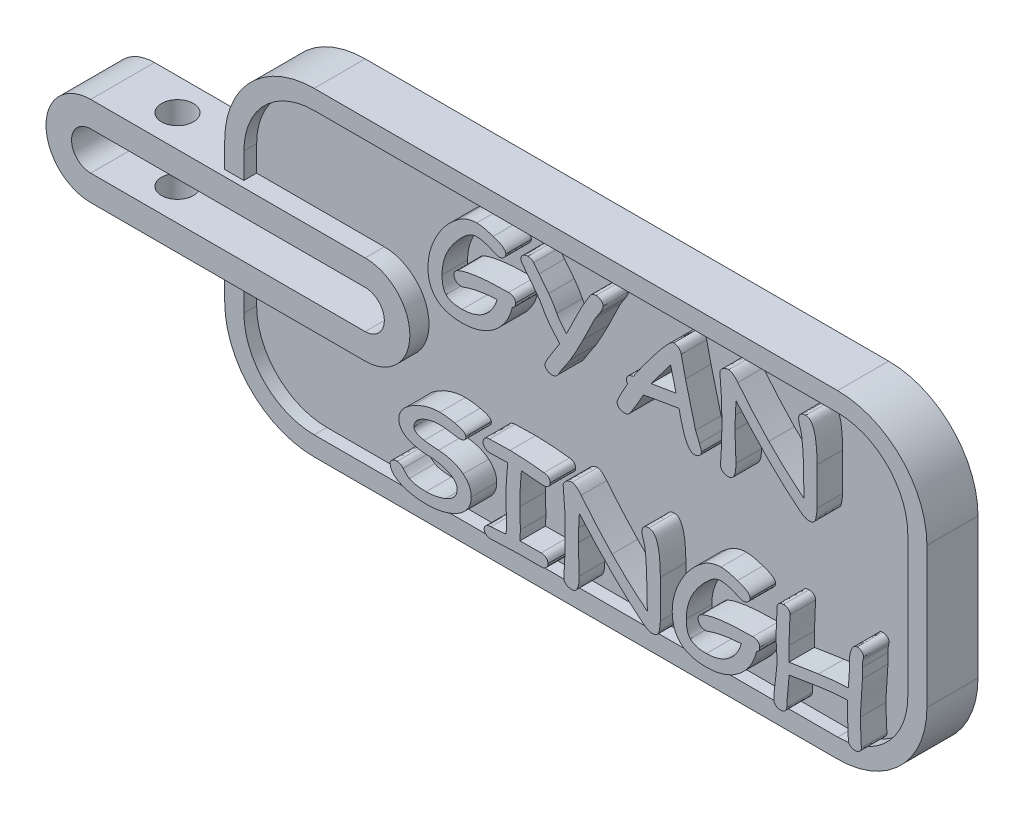
from build123d import *

# Parameters (mm, degrees)
BOSS_EXTRUDE2_DEPTH = 4
CUT_EXTRUDE1_DEPTH  = 1
CUT_EXTRUDE2_START  = -1
CUT_EXTRUDE2_DEPTH  = 1
BOSS_EXTRUDE5_DEPTH = 3.5
BOSS_EXTRUDE6_START = -5
BOSS_EXTRUDE6_DEPTH = 5
CUT_EXTRUDE3_DEPTH  = 5
SKETCH8_W           = 1.5
SKETCH8_H           = 3
CUT_EXTRUDE4_DEPTH  = 5
SKETCH9_R           = 1.25
CUT_EXTRUDE5_DEPTH  = 10
BOSS_EXTRUDE7_DEPTH = 2
SKETCH12_R          = 9.942747639
SKETCH12_R_2        = 8.442747639
SKETCH12_R_3        = 1.486315
SKETCH12_R_4        = 1.403741944
BOSS_EXTRUDE8_DEPTH = 2


with BuildPart() as part:
    # Sketch1 → Boss-Extrude2 (new body)
    with BuildSketch(Plane.XY):
        with BuildLine():
            Line((-20.5, -12.5), (20.5, -12.5))
            ThreePointArc((20.5, -12.5), (25.449747468, -10.449747468), (27.5, -5.5))
            Line((27.5, -5.5), (27.5, 5.5))
            ThreePointArc((27.5, 5.5), (25.449747468, 10.449747468), (20.5, 12.5))
            Line((20.5, 12.5), (-20.5, 12.5))
            ThreePointArc((-20.5, 12.5), (-25.449747468, 10.449747468), (-27.5, 5.5))
            Line((-27.5, 5.5), (-27.5, -5.5))
            ThreePointArc((-27.5, -5.5), (-25.449747468, -10.449747468), (-20.5, -12.5))
        make_face()
    extrude(amount=BOSS_EXTRUDE2_DEPTH)

    # Sketch3 → Cut-Extrude1 (cut)
    with BuildSketch(Plane.XY.offset(4)):
        with BuildLine():
            Line((20.5, 11), (-20.5, 11))
            ThreePointArc((-20.5, 11), (-24.389087297, 9.389087297), (-26, 5.5))
            Line((-26, 5.5), (-26, -5.5))
            ThreePointArc((-26, -5.5), (-24.389087297, -9.389087297), (-20.5, -11))
            Line((-20.5, -11), (20.5, -11))
            ThreePointArc((20.5, -11), (24.389087297, -9.389087297), (26, -5.5))
            Line((26, -5.5), (26, 5.5))
            ThreePointArc((26, 5.5), (24.389087297, 9.389087297), (20.5, 11))
        make_face()
    extrude(amount=-CUT_EXTRUDE1_DEPTH, mode=Mode.SUBTRACT)

    # Sketch4 → Cut-Extrude2 (cut)
    with BuildSketch(Plane(origin=(0, 0, 0), x_dir=(-1, 0, 0), z_dir=(0, 0, -1)).offset(CUT_EXTRUDE2_START)):
        with BuildLine():
            Line((-26, 5.5), (-26, -5.5))
            ThreePointArc((-26, -5.5), (-24.389087297, -9.389087297), (-20.5, -11))
            Line((-20.5, -11), (20.5, -11))
            ThreePointArc((20.5, -11), (24.389087297, -9.389087297), (26, -5.5))
            Line((26, -5.5), (26, 5.5))
            ThreePointArc((26, 5.5), (24.389087297, 9.389087297), (20.5, 11))
            Line((20.5, 11), (-20.5, 11))
            ThreePointArc((-20.5, 11), (-24.389087297, 9.389087297), (-26, 5.5))
        make_face()
    extrude(amount=CUT_EXTRUDE2_DEPTH, mode=Mode.SUBTRACT)

    # Sketch5 → Boss-Extrude5 (add)
    with BuildSketch(Plane.XY.offset(3)):
        with BuildLine():
            Line((-27.5, -1.5), (-37.5, -1.5))
            ThreePointArc((-37.5, -1.5), (-39, 0), (-37.5, 1.5))
            Line((-37.5, 1.5), (-27.5, 1.5))
            Line((-27.5, 1.5), (-26, 1.5))
            Line((-26, 1.5), (-26, 3.5))
            Line((-26, 3.5), (-27.5, 3.5))
            Line((-27.5, 3.5), (-37.5, 3.5))
            ThreePointArc((-37.5, 3.5), (-41, 0), (-37.5, -3.5))
            Line((-37.5, -3.5), (-27.5, -3.5))
            Line((-27.5, -3.5), (-26, -3.5))
            Line((-26, -3.5), (-26, -1.5))
            Line((-26, -1.5), (-27.5, -1.5))
        make_face()
        with BuildLine():
            Line((-16, -1.5), (-26, -1.5))
            Line((-26, -1.5), (-26, -3.5))
            Line((-26, -3.5), (-16, -3.5))
            ThreePointArc((-16, -3.5), (-12.5, 0), (-16, 3.5))
            Line((-16, 3.5), (-26, 3.5))
            Line((-26, 3.5), (-26, 1.5))
            Line((-26, 1.5), (-16, 1.5))
            ThreePointArc((-16, 1.5), (-14.5, 0), (-16, -1.5))
        make_face()
    extrude(amount=-BOSS_EXTRUDE5_DEPTH)

    # Sketch6 → Boss-Extrude6 (add)
    with BuildSketch(Plane(origin=(0, 0, -0.5), x_dir=(-1, 0, 0), z_dir=(0, 0, -1)).offset(BOSS_EXTRUDE6_START)):
        with BuildLine():
            ThreePointArc((16, 3.5), (12.5, 0), (16, -3.5))
            Line((16, -3.5), (37.5, -3.5))
            ThreePointArc((37.5, -3.5), (41, 0), (37.5, 3.5))
            Line((37.5, 3.5), (16, 3.5))
        make_face()
        with BuildLine():
            Line((37.5, -1.5), (16, -1.5))
            ThreePointArc((16, -1.5), (14.5, 0), (16, 1.5))
            Line((16, 1.5), (37.5, 1.5))
            ThreePointArc((37.5, 1.5), (39, 0), (37.5, -1.5))
        make_face(mode=Mode.SUBTRACT)
    extrude(amount=BOSS_EXTRUDE6_DEPTH)

    # Sketch7 → Cut-Extrude3 (cut)
    with BuildSketch(Plane.XY.offset(3)):
        with BuildLine():
            Line((-26, -1.5), (-16, -1.5))
            ThreePointArc((-16, -1.5), (-14.5, 0), (-16, 1.5))
            Line((-16, 1.5), (-26, 1.5))
            Line((-26, 1.5), (-26, -1.5))
        make_face()
    extrude(amount=-CUT_EXTRUDE3_DEPTH, mode=Mode.SUBTRACT)

    # Sketch8 → Cut-Extrude4 (cut)
    with BuildSketch(Plane.XY.offset(4)):
        with Locations((-26.75, 0)):
            Rectangle(SKETCH8_W, SKETCH8_H)
    extrude(amount=-CUT_EXTRUDE4_DEPTH, mode=Mode.SUBTRACT)

    # Sketch9 → Cut-Extrude5 (cut)
    with BuildSketch(Plane.XZ.offset(3.5)):
        with Locations(Location((-33.203112016, 2, 0), (0, 0, 270))):
            Circle(SKETCH9_R)
    extrude(amount=-CUT_EXTRUDE5_DEPTH, mode=Mode.SUBTRACT)

    # Sketch11 → Boss-Extrude7 (add)
    # profile 1 of 9: a face of its own
    with BuildSketch(Plane.XY.offset(3)):
        with BuildLine():
            add(Edge.make_bspline(
                [(-3.978623059, 6.396684907), (-4.008615617, 6.284612445), (-4.067900979, 6.063082268), (-4.186208261, 5.743906968), (-4.327990505, 5.441973211), (-4.494486891, 5.158021937), (-4.682076245, 4.890116911), (-4.89369529, 4.640012736), (-5.128801552, 4.408288742), (-5.38479794, 4.194408512), (-5.658335115, 4.002632342), (-5.945350332, 3.83420081), (-6.245829157, 3.694591072), (-6.557095142, 3.577141194), (-6.881139672, 3.487109028), (-7.217026173, 3.424323499), (-7.564554074, 3.384791263), (-7.800371399, 3.379756565), (-7.919952252, 3.377203515)],
                knots=[0, 0, 0, 0, 1.035644368, 2.047126267, 3.035165067, 4.010913828, 4.983057697, 5.952463116, 6.932436416, 7.927525635, 8.928052116, 9.912586135, 10.895386734, 11.883354933, 12.880622614, 13.894484753, 14.932312071, 16, 16, 16, 16], degree=3))
            add(Edge.make_bspline(
                [(-7.919952252, 3.377203515), (-8.027592353, 3.378767685), (-8.236239779, 3.381799639), (-8.538651293, 3.41116752), (-8.819943564, 3.459573484), (-9.08057438, 3.527087682), (-9.321657728, 3.611901656), (-9.540863488, 3.719731272), (-9.739632447, 3.846099848), (-9.918569241, 3.990740317), (-10.076033707, 4.156090274), (-10.211073358, 4.34175517), (-10.327652311, 4.545133457), (-10.419287617, 4.769360708), (-10.492151608, 5.011638141), (-10.544962035, 5.272756043), (-10.574970765, 5.553487522), (-10.578955337, 5.746778139), (-10.581010755, 5.846485933)],
                knots=[0, 0, 0, 0, 1.240825122, 2.405190709, 3.499130861, 4.528625412, 5.506224502, 6.440576449, 7.338832774, 8.216883655, 9.086997174, 9.963398524, 10.858080717, 11.783233573, 12.74970774, 13.771543642, 14.850464288, 16, 16, 16, 16], degree=3))
            add(Edge.make_bspline(
                [(-10.581010755, 5.846485933), (-10.578846283, 5.943991813), (-10.574497338, 6.139904589), (-10.542978621, 6.43469823), (-10.491368844, 6.731624913), (-10.417980346, 7.030465101), (-10.325293644, 7.331839878), (-10.210593273, 7.634739054), (-10.077321245, 7.940671056), (-9.923085501, 8.244759001), (-9.753913333, 8.54361159), (-9.570224636, 8.829820555), (-9.375956565, 9.102009131), (-9.16844936, 9.357865094), (-8.950857368, 9.599857698), (-8.721054743, 9.827137648), (-8.479360045, 10.039105728), (-8.309121162, 10.168796074), (-8.224148801, 10.233529199)],
                knots=[0, 0, 0, 0, 0.908984365, 1.8263683, 2.760939627, 3.716993638, 4.693400806, 5.69886055, 6.735143991, 7.803149481, 8.876339015, 9.935584257, 10.972454458, 11.99249458, 13.005295775, 14.00513591, 15.004291453, 16, 16, 16, 16], degree=3))
            add(Edge.make_bspline(
                [(-8.224148801, 10.233529199), (-8.167016181, 10.274156908), (-8.054148806, 10.354418288), (-7.876520198, 10.456647562), (-7.697437506, 10.544953727), (-7.515630727, 10.616608873), (-7.331197823, 10.672524986), (-7.144050082, 10.712129976), (-6.954242375, 10.736879123), (-6.826682338, 10.739893033), (-6.762682775, 10.741405176)],
                knots=[0, 0, 0, 0, 1.068368924, 2.110598058, 3.120705482, 4.110569849, 5.086643929, 6.055656026, 7.024481586, 8, 8, 8, 8], degree=3))
            add(Edge.make_bspline(
                [(-6.762682775, 10.741405176), (-6.720322657, 10.74070954), (-6.631883253, 10.739257193), (-6.494365732, 10.724167853), (-6.346738604, 10.705459915), (-6.189703031, 10.675608543), (-6.023407046, 10.636326194), (-5.846090881, 10.592249542), (-5.659787666, 10.537449908), (-5.533019206, 10.49657333), (-5.467863553, 10.475563844)],
                knots=[0, 0, 0, 0, 0.765905697, 1.599056995, 2.500151945, 3.457332709, 4.488362665, 5.590777834, 6.761723202, 8, 8, 8, 8], degree=3))
            add(Edge.make_bspline(
                [(-5.467863553, 10.475563844), (-5.390846707, 10.44954122), (-5.245487556, 10.400426946), (-5.045152973, 10.318066973), (-4.876664861, 10.23123271), (-4.735256619, 10.147506601), (-4.626611674, 10.056929706), (-4.546425698, 9.965528175), (-4.497151628, 9.868453758), (-4.489959387, 9.801507963), (-4.486499036, 9.769298814)],
                knots=[0, 0, 0, 0, 1.533697414, 2.894651812, 4.081360912, 5.108559254, 5.988264905, 6.738040107, 7.392842316, 8, 8, 8, 8], degree=3))
            add(Edge.make_bspline(
                [(-4.486499036, 9.769298814), (-4.488721092, 9.739542864), (-4.493140666, 9.68035955), (-4.523660046, 9.593585926), (-4.577235563, 9.51438296), (-4.646550169, 9.441013914), (-4.729977886, 9.379236044), (-4.824887074, 9.334884842), (-4.927640989, 9.307807587), (-4.999060449, 9.304238189), (-5.035375417, 9.302423242)],
                knots=[0, 0, 0, 0, 0.897409074, 1.784908291, 2.736649818, 3.76210707, 4.81815633, 5.847401382, 6.90545866, 8, 8, 8, 8], degree=3))
            add(Edge.make_bspline(
                [(-5.035375417, 9.302423242), (-5.057070854, 9.304004744), (-5.105581164, 9.307540934), (-5.183440671, 9.328822112), (-5.272340503, 9.364650992), (-5.334865872, 9.393796412), (-5.368669026, 9.409553331)],
                knots=[0, 0, 0, 0, 0.739055088, 1.652503702, 2.730870669, 4, 4, 4, 4], degree=3))
            add(Edge.make_bspline(
                [(-5.368669026, 9.409553331), (-5.435927498, 9.441275473), (-5.566436063, 9.502829224), (-5.760065053, 9.585711864), (-5.945992739, 9.654313045), (-6.123919599, 9.710253273), (-6.293401803, 9.754192893), (-6.454883179, 9.786565949), (-6.608795726, 9.805812598), (-6.708848883, 9.808833531), (-6.7573924, 9.810299218)],
                knots=[0, 0, 0, 0, 1.225051532, 2.377094137, 3.468592955, 4.488514293, 5.448571165, 6.351633995, 7.200250281, 8, 8, 8, 8], degree=3))
            add(Edge.make_bspline(
                [(-6.7573924, 9.810299218), (-6.791397197, 9.809261593), (-6.859770916, 9.807175232), (-6.963117074, 9.790543517), (-7.067101227, 9.762686786), (-7.17256048, 9.723438205), (-7.279325719, 9.674810984), (-7.387207746, 9.614643848), (-7.495611005, 9.542999954), (-7.566258029, 9.488906999), (-7.602529767, 9.461134485)],
                knots=[0, 0, 0, 0, 0.875649582, 1.760675636, 2.689016891, 3.644740636, 4.656066255, 5.70839118, 6.823437561, 8, 8, 8, 8], degree=3))
            add(Edge.make_bspline(
                [(-7.602529767, 9.461134485), (-7.622092443, 9.445456955), (-7.664316548, 9.411618555), (-7.72794597, 9.35337466), (-7.798130942, 9.287324147), (-7.874319438, 9.212259864), (-7.956681855, 9.128404226), (-8.045693869, 9.035735563), (-8.139537653, 8.933410513), (-8.203921642, 8.862046663), (-8.237374738, 8.82496692)],
                knots=[0, 0, 0, 0, 0.668640742, 1.443195044, 2.300160907, 3.239965602, 4.296197662, 5.435835418, 6.667692922, 8, 8, 8, 8], degree=3))
            add(Edge.make_bspline(
                [(-8.237374738, 8.82496692), (-8.336299215, 8.711013937), (-8.530148151, 8.487715669), (-8.782735073, 8.132620167), (-8.999350867, 7.77223324), (-9.17457743, 7.402597522), (-9.312148668, 7.025985021), (-9.408532061, 6.641228426), (-9.469026374, 6.249591651), (-9.476741591, 5.985573558), (-9.480612805, 5.853098901)],
                knots=[0, 0, 0, 0, 1.097605464, 2.150829166, 3.166530949, 4.153867046, 5.123090269, 6.079404016, 7.036314936, 8, 8, 8, 8], degree=3))
            add(Edge.make_bspline(
                [(-9.480612805, 5.853098901), (-9.47961665, 5.78561088), (-9.477699995, 5.655760345), (-9.462609725, 5.468613632), (-9.440793024, 5.296613944), (-9.403815966, 5.141487599), (-9.361742208, 5.001111112), (-9.306434039, 4.877543209), (-9.244866362, 4.767006988), (-9.191585048, 4.705645167), (-9.165835507, 4.675990518)],
                knots=[0, 0, 0, 0, 1.300667245, 2.502552799, 3.61785719, 4.638277078, 5.573618544, 6.437345681, 7.24480784, 8, 8, 8, 8], degree=3))
            add(Edge.make_bspline(
                [(-9.165835507, 4.675990518), (-9.134899552, 4.646368119), (-9.071323752, 4.585491781), (-8.957298785, 4.510340237), (-8.825210557, 4.447977399), (-8.67543769, 4.397369123), (-8.508237078, 4.356367484), (-8.323276955, 4.327932957), (-8.120436067, 4.310713605), (-7.979064986, 4.30913303), (-7.905403722, 4.308309472)],
                knots=[0, 0, 0, 0, 0.761786682, 1.565531019, 2.41910613, 3.357916235, 4.376962725, 5.482183563, 6.688094192, 8, 8, 8, 8], degree=3))
            add(Edge.make_bspline(
                [(-7.905403722, 4.308309472), (-7.825547997, 4.309779821), (-7.668557587, 4.312670418), (-7.436899654, 4.33714344), (-7.213442584, 4.37707589), (-6.996995706, 4.430080982), (-6.789937762, 4.503216594), (-6.589473209, 4.587994443), (-6.398169042, 4.692184155), (-6.277181472, 4.772102524), (-6.216451581, 4.812217668)],
                knots=[0, 0, 0, 0, 1.069976016, 2.103493187, 3.117593053, 4.110631834, 5.085972143, 6.057259799, 7.024838656, 8, 8, 8, 8], degree=3))
            add(Edge.make_bspline(
                [(-6.216451581, 4.812217668), (-6.1551402, 4.857827627), (-6.032468417, 4.949084011), (-5.865298698, 5.105807588), (-5.712161606, 5.276461359), (-5.57263137, 5.460608037), (-5.448856896, 5.66007658), (-5.336374746, 5.872264518), (-5.241692053, 6.100422428), (-5.189939939, 6.259204615), (-5.163667005, 6.339813379)],
                knots=[0, 0, 0, 0, 0.969525904, 1.939826989, 2.902933839, 3.877953399, 4.86874971, 5.880198957, 6.923843138, 8, 8, 8, 8], degree=3))
            add(Edge.make_bspline(
                [(-5.163667005, 6.339813379), (-5.287615983, 6.334185213), (-5.531400185, 6.323115674), (-5.889389461, 6.289973597), (-6.234205077, 6.250450627), (-6.564766031, 6.196424318), (-6.882932387, 6.135726826), (-7.186873216, 6.060396181), (-7.47867778, 5.979231895), (-7.665486064, 5.912392113), (-7.757273229, 5.879550775)],
                knots=[0, 0, 0, 0, 1.12579329, 2.214222509, 3.26176832, 4.274661082, 5.253063964, 6.200103296, 7.115631217, 8, 8, 8, 8], degree=3))
            add(Edge.make_bspline(
                [(-7.757273229, 5.879550775), (-7.798336434, 5.865666784), (-7.878211673, 5.838659953), (-7.962378368, 5.83413575), (-8.003275655, 5.831937402)],
                knots=[0, 0, 0, 0, 1.028183606, 2, 2, 2, 2], degree=3))
            add(Edge.make_bspline(
                [(-8.003275655, 5.831937402), (-8.041878078, 5.833877641), (-8.11683526, 5.837645147), (-8.223625743, 5.869781247), (-8.321881574, 5.919673037), (-8.375508154, 5.969401918), (-8.402698949, 5.994616426)],
                knots=[0, 0, 0, 0, 1.043820251, 2.02686304, 2.999541586, 4, 4, 4, 4], degree=3))
            add(Edge.make_bspline(
                [(-8.402698949, 5.994616426), (-8.42550746, 6.019756225), (-8.46960625, 6.068362412), (-8.51485196, 6.154756642), (-8.544434243, 6.245732169), (-8.547806809, 6.309162228), (-8.549506848, 6.341135972)],
                knots=[0, 0, 0, 0, 1.051355824, 2.032728924, 3.008340488, 4, 4, 4, 4], degree=3))
            add(Edge.make_bspline(
                [(-8.549506848, 6.341135972), (-8.546678722, 6.383743846), (-8.541093653, 6.467887157), (-8.480536827, 6.583718608), (-8.389210251, 6.686336444), (-8.308226243, 6.736408837), (-8.265149205, 6.763043359)],
                knots=[0, 0, 0, 0, 0.948865754, 1.873848626, 2.869056945, 4, 4, 4, 4], degree=3))
            add(Edge.make_bspline(
                [(-8.265149205, 6.763043359), (-8.214691491, 6.784396638), (-8.110928776, 6.828308142), (-7.945502662, 6.883876946), (-7.768323038, 6.939355747), (-7.576576969, 6.986465762), (-7.372857064, 7.034077491), (-7.155397179, 7.073623391), (-6.925526205, 7.113117775), (-6.681774321, 7.144755731), (-6.425377249, 7.176348177), (-6.155292701, 7.200058274), (-5.872816383, 7.223682677), (-5.576822206, 7.239570939), (-5.268276975, 7.255252207), (-4.945904284, 7.263166149), (-4.610859911, 7.270982404), (-4.38290132, 7.2709406), (-4.266948484, 7.270919336)],
                knots=[0, 0, 0, 0, 0.648552844, 1.333702959, 2.065252413, 2.846469901, 3.670917488, 4.542228679, 5.463112791, 6.432497235, 7.452352995, 8.521929412, 9.642620494, 10.808752431, 12.031681591, 13.300771853, 14.627017481, 16, 16, 16, 16], degree=3))
            add(Edge.make_bspline(
                [(-4.266948484, 7.270919336), (-4.229793238, 7.26946565), (-4.157749677, 7.26664697), (-4.054355771, 7.242857987), (-3.961247503, 7.200923949), (-3.879763403, 7.143909985), (-3.810078263, 7.076292909), (-3.760178816, 6.996447405), (-3.729184451, 6.907653764), (-3.726211002, 6.845300642), (-3.724685071, 6.813301919)],
                knots=[0, 0, 0, 0, 1.125614118, 2.182551801, 3.193616843, 4.202116512, 5.185048592, 6.115890735, 7.033102282, 8, 8, 8, 8], degree=3))
            add(Edge.make_bspline(
                [(-3.724685071, 6.813301919), (-3.727358292, 6.767827031), (-3.732482207, 6.680662713), (-3.782492772, 6.56056103), (-3.865302607, 6.461236731), (-3.939891985, 6.418747663), (-3.978623059, 6.396684907)],
                knots=[0, 0, 0, 0, 1.05277829, 2.017920323, 2.970790782, 4, 4, 4, 4], degree=3))
        make_face()
    # profile 2 of 9: a face of its own
    with BuildSketch(Plane.XY.offset(3)):
        with BuildLine():
            add(Edge.make_bspline(
                [(2.845960376, 9.410875924), (2.822384798, 9.378841744), (2.770395337, 9.308199156), (2.689944277, 9.188473942), (2.599109405, 9.045764827), (2.535857377, 8.94234596), (2.502086017, 8.887128824)],
                knots=[0, 0, 0, 0, 0.761420662, 1.679104164, 2.760833242, 4, 4, 4, 4], degree=3))
            Line((2.502086017, 8.887128824), (1.576270434, 6.986561693))
            add(Edge.make_bspline(
                [(1.576270434, 6.986561693), (1.488693035, 6.813434492), (1.318679788, 6.477344153), (1.061373678, 5.993139457), (0.814026052, 5.541743939), (0.646652194, 5.254942389), (0.565808856, 5.116414216)],
                knots=[0, 0, 0, 0, 1.095050166, 2.125811419, 3.094747154, 4, 4, 4, 4], degree=3))
            Line((0.565808856, 5.116414216), (-0.106068738, 4.115210794))
            Line((-0.106068738, 4.115210794), (-0.391748975, 3.631141504))
            add(Edge.make_bspline(
                [(-0.391748975, 3.631141504), (-0.422180717, 3.592371854), (-0.480840186, 3.51764044), (-0.596388419, 3.435807172), (-0.727692555, 3.385379906), (-0.821129392, 3.379981268), (-0.869205297, 3.377203515)],
                knots=[0, 0, 0, 0, 1.04567251, 2.015612334, 2.978976219, 4, 4, 4, 4], degree=3))
            add(Edge.make_bspline(
                [(-0.869205297, 3.377203515), (-0.903774261, 3.378526973), (-0.972103465, 3.381142926), (-1.070910142, 3.408169104), (-1.165608772, 3.447923091), (-1.251989598, 3.504161542), (-1.328019377, 3.570618941), (-1.381725322, 3.649713064), (-1.418265755, 3.735686236), (-1.421648122, 3.796971834), (-1.423372052, 3.828207963)],
                knots=[0, 0, 0, 0, 1.049639563, 2.074723263, 3.09655286, 4.164723405, 5.199942853, 6.145266164, 7.054676689, 8, 8, 8, 8], degree=3))
            add(Edge.make_bspline(
                [(-1.423372052, 3.828207963), (-1.421230018, 3.844199505), (-1.415858357, 3.884302098), (-1.389071697, 3.952476325), (-1.349090324, 4.041367527), (-1.293280152, 4.150095976), (-1.222697636, 4.279526442), (-1.134952776, 4.427816414), (-1.033196176, 4.598149495), (-0.958095697, 4.717160182), (-0.918141263, 4.780475419)],
                knots=[0, 0, 0, 0, 0.356699349, 0.894508441, 1.61197935, 2.521125192, 3.60143984, 4.880424969, 6.340345403, 8, 8, 8, 8], degree=3))
            Line((-0.918141263, 4.780475419), (-0.259489606, 5.792259591))
            add(Edge.make_bspline(
                [(-0.259489606, 5.792259591), (-0.336477783, 5.875768949), (-0.484812837, 6.036668527), (-0.6944535, 6.273006945), (-0.881023094, 6.49732148), (-1.048231202, 6.706960887), (-1.193689368, 6.903819572), (-1.318774623, 7.086465402), (-1.423060524, 7.255078692), (-1.479992263, 7.365796358), (-1.506695455, 7.417727235)],
                knots=[0, 0, 0, 0, 1.326441709, 2.555688565, 3.688854899, 4.73334538, 5.686879026, 6.546543571, 7.318272603, 8, 8, 8, 8], degree=3))
            add(Edge.make_bspline(
                [(-1.506695455, 7.417727235), (-1.528436126, 7.461090751), (-1.573439424, 7.550853447), (-1.649099202, 7.686599756), (-1.733840143, 7.829158629), (-1.830968589, 7.97645094), (-1.936780452, 8.131221365), (-2.051543492, 8.29274007), (-2.17767201, 8.459549006), (-2.266520149, 8.571646619), (-2.312155011, 8.629223054)],
                knots=[0, 0, 0, 0, 0.798585523, 1.653076053, 2.558083887, 3.52849487, 4.557307139, 5.64496966, 6.790391262, 8, 8, 8, 8], degree=3))
            add(Edge.make_bspline(
                [(-2.312155011, 8.629223054), (-2.373563743, 8.705390055), (-2.489726376, 8.849469883), (-2.652591965, 9.055467737), (-2.79638493, 9.236703665), (-2.919408574, 9.395204302), (-3.024310956, 9.52778497), (-3.107521686, 9.637992113), (-3.171548507, 9.723589456), (-3.206327746, 9.773636085), (-3.220776876, 9.794428094)],
                knots=[0, 0, 0, 0, 1.588940249, 3.005687952, 4.264785282, 5.346137291, 6.264219921, 7.010289561, 7.58882209, 8, 8, 8, 8], degree=3))
            add(Edge.make_bspline(
                [(-3.220776876, 9.794428094), (-3.244457892, 9.833432486), (-3.289329273, 9.907338981), (-3.29756554, 9.993247521), (-3.301455091, 10.033817552)],
                knots=[0, 0, 0, 0, 1.055506457, 2, 2, 2, 2], degree=3))
            add(Edge.make_bspline(
                [(-3.301455091, 10.033817552), (-3.299531108, 10.064975122), (-3.295740587, 10.126359974), (-3.261886885, 10.213687732), (-3.207276551, 10.292219619), (-3.132920361, 10.359278599), (-3.04677815, 10.415752919), (-2.951900739, 10.456772952), (-2.851457795, 10.483448274), (-2.782285104, 10.486116993), (-2.747288335, 10.487467187)],
                knots=[0, 0, 0, 0, 0.941724804, 1.85533206, 2.797056864, 3.818500829, 4.871381168, 5.906895511, 6.941028707, 8, 8, 8, 8], degree=3))
            add(Edge.make_bspline(
                [(-2.747288335, 10.487467187), (-2.70508648, 10.484940066), (-2.621950526, 10.47996174), (-2.503526684, 10.439872399), (-2.395036912, 10.375215915), (-2.336852397, 10.314010084), (-2.306864637, 10.282465165)],
                knots=[0, 0, 0, 0, 1.008364134, 1.986436757, 2.962228159, 4, 4, 4, 4], degree=3))
            Line((-2.306864637, 10.282465165), (-1.877021688, 9.72829841))
            add(Edge.make_bspline(
                [(-1.877021688, 9.72829841), (-1.831577844, 9.672337161), (-1.74442373, 9.565012325), (-1.619843088, 9.410467949), (-1.508631085, 9.268874014), (-1.406242661, 9.143720089), (-1.320747598, 9.02920846), (-1.242784777, 8.932106681), (-1.179283429, 8.847103934), (-1.141590978, 8.794596626), (-1.124465879, 8.770740579)],
                knots=[0, 0, 0, 0, 1.42042247, 2.72414591, 3.911203397, 4.968017509, 5.909709692, 6.726441006, 7.421374207, 8, 8, 8, 8], degree=3))
            add(Edge.make_bspline(
                [(-1.124465879, 8.770740579), (-1.060273044, 8.681294228), (-0.935684879, 8.507692973), (-0.766495868, 8.247722158), (-0.619845519, 7.997450786), (-0.53557725, 7.83123354), (-0.494911283, 7.751020845)],
                knots=[0, 0, 0, 0, 1.100902799, 2.136678653, 3.100803129, 4, 4, 4, 4], degree=3))
            add(Edge.make_bspline(
                [(-0.494911283, 7.751020845), (-0.478566599, 7.718613798), (-0.443693194, 7.649469355), (-0.379479222, 7.544552509), (-0.303699844, 7.4302325), (-0.215125432, 7.307492745), (-0.113032432, 7.176994323), (0.00124317, 7.038075198), (0.126824435, 6.889465848), (0.216407971, 6.788848853), (0.262934901, 6.736591485)],
                knots=[0, 0, 0, 0, 0.685749124, 1.463130559, 2.322831805, 3.277910929, 4.322965778, 5.453884321, 6.677625935, 8, 8, 8, 8], degree=3))
            Line((0.262934901, 6.736591485), (1.495592219, 9.231003183))
            add(Edge.make_bspline(
                [(1.495592219, 9.231003183), (1.514259049, 9.258236998), (1.553669113, 9.315733979), (1.612854892, 9.408841632), (1.677897787, 9.512570707), (1.748703752, 9.625886421), (1.823240839, 9.750732112), (1.903752162, 9.885030541), (1.989848473, 10.03019027), (2.04768997, 10.131169922), (2.077533442, 10.183270639)],
                knots=[0, 0, 0, 0, 0.70984117, 1.498641476, 2.371779909, 3.342382395, 4.371398034, 5.497950467, 6.709060988, 8, 8, 8, 8], degree=3))
            add(Edge.make_bspline(
                [(2.077533442, 10.183270639), (2.090675426, 10.207376418), (2.116185799, 10.254169007), (2.162349475, 10.317904821), (2.218023007, 10.369135374), (2.277069246, 10.413789089), (2.343505526, 10.447062543), (2.415522033, 10.471358116), (2.494601701, 10.483943497), (2.54922072, 10.486265875), (2.577473857, 10.487467187)],
                knots=[0, 0, 0, 0, 1.061755526, 2.06101155, 3.02592263, 3.977482095, 4.915499921, 5.886119694, 6.90653929, 8, 8, 8, 8], degree=3))
            add(Edge.make_bspline(
                [(2.577473857, 10.487467187), (2.612462337, 10.486037785), (2.681512884, 10.483216827), (2.781643515, 10.457838517), (2.877281353, 10.420171374), (2.96243492, 10.364355418), (3.038243335, 10.30014107), (3.091961563, 10.221504318), (3.126118429, 10.133909788), (3.129772897, 10.072047125), (3.131640613, 10.04043052)],
                knots=[0, 0, 0, 0, 1.062365448, 2.09660194, 3.12499795, 4.173993351, 5.180654633, 6.1253978, 7.041933298, 8, 8, 8, 8], degree=3))
            add(Edge.make_bspline(
                [(3.131640613, 10.04043052), (3.130830159, 10.022291758), (3.129072385, 9.982951024), (3.114574106, 9.920913131), (3.09226571, 9.852216274), (3.058756061, 9.777564496), (3.020313625, 9.69466088), (2.970416764, 9.605937629), (2.911921782, 9.510381427), (2.868663176, 9.445124035), (2.845960376, 9.410875924)],
                knots=[0, 0, 0, 0, 0.622065366, 1.349182932, 2.177022211, 3.098949466, 4.154824588, 5.312981368, 6.589810159, 8, 8, 8, 8], degree=3))
        make_face()
    # profile 3 of 9: a face of its own
    with BuildSketch(Plane.XY.offset(3)):
        with BuildLine():
            add(Edge.make_bspline(
                [(10.293485438, 3.546495508), (10.252784693, 3.54982921), (10.169870003, 3.556620558), (10.050965196, 3.614199063), (9.936931305, 3.702029953), (9.830949839, 3.827661148), (9.725840153, 3.983874709), (9.626894599, 4.175230425), (9.531632518, 4.400641512), (9.475512301, 4.56405877), (9.445702884, 4.650861238)],
                knots=[0, 0, 0, 0, 0.660925651, 1.346423655, 2.115779037, 2.99709471, 4.012122428, 5.182822105, 6.503597499, 8, 8, 8, 8], degree=3))
            add(Edge.make_bspline(
                [(9.445702884, 4.650861238), (9.433194591, 4.688281209), (9.40622787, 4.7689552), (9.366561276, 4.899823374), (9.326315127, 5.050189898), (9.280624287, 5.219072881), (9.234780847, 5.407914754), (9.187987014, 5.615955562), (9.135306466, 5.842121216), (9.101976916, 5.999841973), (9.084634807, 6.081907609)],
                knots=[0, 0, 0, 0, 0.641244705, 1.382464189, 2.222059324, 3.171022673, 4.225905395, 5.38005334, 6.636783184, 8, 8, 8, 8], degree=3))
            add(Edge.make_bspline(
                [(9.084634807, 6.081907609), (9.038319742, 6.076361717), (8.94204513, 6.064833532), (8.793140921, 6.043216605), (8.634007003, 6.019295077), (8.464572961, 5.993234184), (8.2848702, 5.962201825), (8.094244314, 5.929656737), (7.893787683, 5.892274253), (7.75674465, 5.86635529), (7.686653277, 5.853098901)],
                knots=[0, 0, 0, 0, 0.790101177, 1.642374555, 2.548530537, 3.516001174, 4.546037141, 5.637479607, 6.791676637, 8, 8, 8, 8], degree=3))
            Line((7.686653277, 5.853098901), (6.292639529, 5.6018061))
            add(Edge.make_bspline(
                [(6.292639529, 5.6018061), (6.266116068, 5.549586252), (6.209919827, 5.438946122), (6.112841467, 5.267583735), (6.007260088, 5.076619432), (5.884176902, 4.871158035), (5.751301579, 4.646682113), (5.602775309, 4.407172841), (5.442531366, 4.149284002), (5.329973973, 3.972696869), (5.271597201, 3.881111711)],
                knots=[0, 0, 0, 0, 0.702205874, 1.487789632, 2.361185406, 3.318579069, 4.359353742, 5.489044622, 6.697717996, 8, 8, 8, 8], degree=3))
            add(Edge.make_bspline(
                [(5.271597201, 3.881111711), (5.241651521, 3.842730745), (5.183729876, 3.76849337), (5.068101202, 3.688299755), (4.936729545, 3.639635762), (4.843507673, 3.634030377), (4.795463473, 3.631141504)],
                knots=[0, 0, 0, 0, 1.038112708, 2.007942224, 2.973343693, 4, 4, 4, 4], degree=3))
            add(Edge.make_bspline(
                [(4.795463473, 3.631141504), (4.760017518, 3.632463768), (4.689958762, 3.635077216), (4.588528114, 3.662107118), (4.491559737, 3.701592811), (4.403088319, 3.757614376), (4.327896575, 3.8259415), (4.272883972, 3.905484398), (4.237594057, 3.992925012), (4.23389755, 4.054930778), (4.232038562, 4.086113733)],
                knots=[0, 0, 0, 0, 1.060112501, 2.095307105, 3.126021972, 4.189177353, 5.21768748, 6.148709225, 7.068978255, 8, 8, 8, 8], degree=3))
            add(Edge.make_bspline(
                [(4.232038562, 4.086113733), (4.232537139, 4.096756708), (4.233698514, 4.121548204), (4.246352206, 4.162217866), (4.261834916, 4.213120051), (4.284334704, 4.273211121), (4.314110728, 4.342610617), (4.349911606, 4.421295573), (4.390374064, 4.510602776), (4.440177339, 4.607634891), (4.494039668, 4.715842645), (4.556218784, 4.83221758), (4.624052971, 4.958775302), (4.697879411, 5.094696953), (4.778531956, 5.240203849), (4.866166637, 5.394505888), (4.958253974, 5.55929434), (5.023637663, 5.67113261), (5.057337024, 5.728775094)],
                knots=[0, 0, 0, 0, 0.276369849, 0.643769381, 1.101070131, 1.663844365, 2.311785902, 3.066826767, 3.914005249, 4.863436213, 5.905256884, 7.060255298, 8.297603194, 9.642995802, 11.086418833, 12.627959933, 14.262019208, 16, 16, 16, 16], degree=3))
            add(Edge.make_bspline(
                [(5.057337024, 5.728775094), (5.042734066, 5.748526188), (5.014096861, 5.787259171), (4.987271936, 5.854683933), (4.96685577, 5.924628373), (4.965461117, 5.973736822), (4.964755465, 5.998584207)],
                knots=[0, 0, 0, 0, 1.009744039, 1.9801637, 2.9780241, 4, 4, 4, 4], degree=3))
            add(Edge.make_bspline(
                [(4.964755465, 5.998584207), (4.966097911, 6.027861135), (4.968715234, 6.08494139), (4.994560939, 6.166338104), (5.038935479, 6.237998987), (5.097797421, 6.302849844), (5.175593402, 6.356984854), (5.268762106, 6.403083112), (5.378976921, 6.439665909), (5.458337737, 6.457388075), (5.500405909, 6.466782373)],
                knots=[0, 0, 0, 0, 0.899971203, 1.754643976, 2.595393939, 3.479654745, 4.433155206, 5.495952632, 6.672635905, 8, 8, 8, 8], degree=3))
            add(Edge.make_bspline(
                [(5.500405909, 6.466782373), (5.553966738, 6.547172085), (5.663602664, 6.711725186), (5.836024337, 6.961079362), (6.016606724, 7.220622413), (6.209014299, 7.487803222), (6.411303645, 7.764289047), (6.624052273, 8.04935486), (6.846469547, 8.343591275), (6.99918003, 8.541617458), (7.076937587, 8.642448991)],
                knots=[0, 0, 0, 0, 0.862657079, 1.765809254, 2.707313854, 3.686302139, 4.706091037, 5.766762513, 6.862873797, 8, 8, 8, 8], degree=3))
            add(Edge.make_bspline(
                [(7.076937587, 8.642448991), (7.128802921, 8.710023435), (7.229802644, 8.841614221), (7.379257314, 9.030938219), (7.518704161, 9.209038028), (7.653060414, 9.372010009), (7.779706227, 9.521875702), (7.897137869, 9.660458346), (8.008426457, 9.784253259), (8.111128876, 9.896274222), (8.20832813, 9.993114305), (8.294468696, 10.080395113), (8.376082561, 10.151875767), (8.448788932, 10.211305932), (8.514685384, 10.257390195), (8.572578856, 10.291070022), (8.623790051, 10.312856662), (8.656416465, 10.316558685), (8.670662982, 10.318175195)],
                knots=[0, 0, 0, 0, 1.749371826, 3.406631238, 4.95355036, 6.394514847, 7.743880077, 8.983206506, 10.124572584, 11.162419658, 12.103546302, 12.942242421, 13.679843582, 14.33027665, 14.870256576, 15.328441159, 15.706759854, 16, 16, 16, 16], degree=3))
            add(Edge.make_bspline(
                [(8.670662982, 10.318175195), (8.70516466, 10.316633318), (8.771864281, 10.313652517), (8.867676083, 10.291169199), (8.953946739, 10.251309911), (9.033264515, 10.198410772), (9.102404898, 10.128108361), (9.162429651, 10.04299977), (9.214032161, 9.94313137), (9.24025353, 9.869734104), (9.253926799, 9.831460718)],
                knots=[0, 0, 0, 0, 1.008789824, 1.950221022, 2.856280161, 3.775458072, 4.723752771, 5.722103986, 6.812179257, 8, 8, 8, 8], degree=3))
            Line((9.253926799, 9.831460718), (9.588543002, 8.334284662))
            Line((9.588543002, 8.334284662), (10.378131434, 5.235447648))
            Line((10.378131434, 5.235447648), (10.681005389, 4.508021119))
            add(Edge.make_bspline(
                [(10.681005389, 4.508021119), (10.704210753, 4.451396323), (10.746143344, 4.349074101), (10.792819943, 4.208859413), (10.826408552, 4.100386542), (10.832088025, 4.036873953), (10.834426257, 4.010725892)],
                knots=[0, 0, 0, 0, 1.404800727, 2.538505072, 3.398304213, 4, 4, 4, 4], degree=3))
            add(Edge.make_bspline(
                [(10.834426257, 4.010725892), (10.832321576, 3.979195642), (10.828158065, 3.91682202), (10.796859273, 3.827269219), (10.742622286, 3.747569318), (10.67198081, 3.677278756), (10.58772561, 3.619860433), (10.495490584, 3.576649311), (10.396295423, 3.550640963), (10.328024777, 3.547888186), (10.293485438, 3.546495508)],
                knots=[0, 0, 0, 0, 0.95778085, 1.894696644, 2.842766023, 3.866476231, 4.907591803, 5.927168634, 6.951317581, 8, 8, 8, 8], degree=3))
        make_face()
        with BuildLine():
            Line((8.422015368, 8.704610895), (6.890451877, 6.670461801))
            add(Edge.make_bspline(
                [(6.890451877, 6.670461801), (6.947748877, 6.68200121), (7.069295119, 6.706480184), (7.26229806, 6.7436376), (7.476609951, 6.7817861), (7.711617695, 6.821362669), (7.967452679, 6.861993086), (8.243732572, 6.906123888), (8.541465823, 6.95057379), (8.746933037, 6.981269549), (8.853180911, 6.997142442)],
                knots=[0, 0, 0, 0, 0.704896645, 1.495323266, 2.370367166, 3.330138159, 4.369469301, 5.494486, 6.704389237, 8, 8, 8, 8], degree=3))
            Line((8.853180911, 6.997142442), (8.422015368, 8.704610895))
        make_face(mode=Mode.SUBTRACT)
    # profile 4 of 9: a face of its own
    with BuildSketch(Plane.XY.offset(3)):
        with BuildLine():
            add(Edge.make_bspline(
                [(19.891547839, 4.711700548), (19.890248019, 4.670229572), (19.887254591, 4.574723721), (19.869736429, 4.414187676), (19.843054495, 4.217544924), (19.81964056, 4.075034806), (19.806901843, 3.997499955)],
                knots=[0, 0, 0, 0, 0.691506549, 1.592509447, 2.69016726, 4, 4, 4, 4], degree=3))
            add(Edge.make_bspline(
                [(19.806901843, 3.997499955), (19.799346949, 3.961846953), (19.78489886, 3.893663637), (19.743908419, 3.801002197), (19.692538342, 3.720952446), (19.626266568, 3.656310242), (19.547592242, 3.60676153), (19.457228677, 3.570583829), (19.354209512, 3.549578879), (19.281491058, 3.547554019), (19.243476931, 3.546495508)],
                knots=[0, 0, 0, 0, 1.094311307, 2.09277668, 3.031328539, 3.941590185, 4.85455635, 5.813158652, 6.856812029, 8, 8, 8, 8], degree=3))
            add(Edge.make_bspline(
                [(19.243476931, 3.546495508), (19.218731339, 3.547696768), (19.167532643, 3.550182179), (19.089311557, 3.565225684), (19.007859092, 3.590910117), (18.923406465, 3.627413292), (18.834482623, 3.671961237), (18.743509101, 3.728694328), (18.64776884, 3.79285809), (18.585372725, 3.842299879), (18.553083026, 3.867885774)],
                knots=[0, 0, 0, 0, 0.766554426, 1.586003079, 2.458344293, 3.40675959, 4.43260487, 5.53551506, 6.724640537, 8, 8, 8, 8], degree=3))
            add(Edge.make_bspline(
                [(18.553083026, 3.867885774), (18.461073288, 3.941129195), (18.273800913, 4.090205475), (17.994555894, 4.324371444), (17.709570506, 4.569825305), (17.418823443, 4.825720397), (17.123405071, 5.094686484), (16.824111821, 5.376555825), (16.51809942, 5.668355075), (16.208299036, 5.973622159), (15.893000892, 6.290113757), (15.572602117, 6.618696476), (15.246839939, 6.958691427), (14.916992483, 7.311317103), (14.582115779, 7.676055578), (14.240326059, 8.050835478), (13.896038217, 8.440029911), (13.665108877, 8.703634563), (13.548388507, 8.836870263)],
                knots=[0, 0, 0, 0, 0.799303285, 1.626865024, 2.476784956, 3.355716589, 4.259340447, 5.192105779, 6.150059849, 7.13324228, 8.148173125, 9.18648693, 10.252522759, 11.348559704, 12.468282653, 13.618019358, 14.796057438, 16, 16, 16, 16], degree=3))
            Line((13.548388507, 8.836870263), (13.495484759, 7.823763498))
            Line((13.495484759, 7.823763498), (13.463742511, 6.805366357))
            add(Edge.make_bspline(
                [(13.463742511, 6.805366357), (13.4635326, 6.77273963), (13.463084346, 6.703066662), (13.466919005, 6.592880673), (13.468339903, 6.471143554), (13.474929499, 6.338070854), (13.479413365, 6.19342209), (13.486341301, 6.036924135), (13.494190562, 5.868949801), (13.503437392, 5.693065738), (13.512584066, 5.517177724), (13.520707508, 5.349214206), (13.526734366, 5.192662671), (13.534242315, 5.047689603), (13.537939323, 4.91406926), (13.540052341, 4.791931522), (13.543739232, 4.681299165), (13.543303592, 4.61118592), (13.543098132, 4.578118585)],
                knots=[0, 0, 0, 0, 0.702563462, 1.500293951, 2.373957597, 3.324126905, 4.369168249, 5.490477428, 6.697573105, 7.990480023, 9.28338694, 10.490482617, 11.611791796, 12.657221206, 13.616548302, 14.490211949, 15.287942437, 16, 16, 16, 16], degree=3))
            add(Edge.make_bspline(
                [(13.543098132, 4.578118585), (13.542540292, 4.529613531), (13.541459581, 4.435644139), (13.534595327, 4.299366059), (13.524931448, 4.172584389), (13.508322054, 4.055347145), (13.489708672, 3.947263212), (13.46368474, 3.848631744), (13.435847452, 3.758720907), (13.400946679, 3.678879118), (13.362725778, 3.608317554), (13.320467622, 3.546411233), (13.272529763, 3.494605592), (13.220601147, 3.451631143), (13.164102657, 3.417838052), (13.102975739, 3.39372446), (13.036642336, 3.380697387), (12.991188643, 3.37839154), (12.967769877, 3.377203515)],
                knots=[0, 0, 0, 0, 1.576872551, 3.054893073, 4.435614689, 5.708577121, 6.903371833, 7.998404267, 9.022775987, 9.960016351, 10.825937942, 11.62908849, 12.38980976, 13.112872578, 13.813424309, 14.521414188, 15.238199309, 16, 16, 16, 16], degree=3))
            add(Edge.make_bspline(
                [(12.967769877, 3.377203515), (12.919473757, 3.378457651), (12.827097644, 3.380856439), (12.697732621, 3.413304774), (12.580878467, 3.458776134), (12.517545436, 3.508683685), (12.486345775, 3.533269571)],
                knots=[0, 0, 0, 0, 1.117814492, 2.138046654, 3.08274857, 4, 4, 4, 4], degree=3))
            add(Edge.make_bspline(
                [(12.486345775, 3.533269571), (12.462254783, 3.556562199), (12.415727567, 3.601547527), (12.36645694, 3.683476557), (12.33331062, 3.771048876), (12.33041798, 3.832754917), (12.328957126, 3.863917993)],
                knots=[0, 0, 0, 0, 1.060533042, 2.048219937, 3.014302807, 4, 4, 4, 4], degree=3))
            add(Edge.make_bspline(
                [(12.328957126, 3.863917993), (12.329648814, 3.899193787), (12.331188659, 3.977725119), (12.338427639, 4.107788176), (12.34900985, 4.261660061), (12.362855023, 4.431390533), (12.379531471, 4.600878028), (12.389473859, 4.754842654), (12.396843104, 4.884894531), (12.398369116, 4.963427051), (12.399054591, 4.998703378)],
                knots=[0, 0, 0, 0, 0.744558585, 1.657543932, 2.748662473, 3.999602223, 5.251337527, 6.342456068, 7.255441415, 8, 8, 8, 8], degree=3))
            add(Edge.make_bspline(
                [(12.399054591, 4.998703378), (12.399358676, 5.050727232), (12.400031339, 5.165808551), (12.404458416, 5.355824704), (12.410955018, 5.579791791), (12.420420518, 5.827081158), (12.428789599, 6.073979819), (12.437754929, 6.298322151), (12.441622635, 6.487929281), (12.442366679, 6.603008552), (12.442700183, 6.654590677)],
                knots=[0, 0, 0, 0, 0.753718613, 1.667291548, 2.753587902, 3.99989736, 5.252589944, 6.332709616, 7.252668373, 8, 8, 8, 8], degree=3))
            add(Edge.make_bspline(
                [(12.442700183, 6.654590677), (12.442304337, 6.710139975), (12.441424655, 6.833586448), (12.438866945, 7.037719484), (12.43354236, 7.279321631), (12.4250102, 7.545994396), (12.419325586, 7.812741385), (12.413357848, 8.054315276), (12.410931137, 8.258451726), (12.410037476, 8.381897835), (12.409635341, 8.437446969)],
                knots=[0, 0, 0, 0, 0.747650578, 1.661494007, 2.747592627, 4.000077306, 5.252407373, 6.338505993, 7.252349422, 8, 8, 8, 8], degree=3))
            add(Edge.make_bspline(
                [(12.409635341, 8.437446969), (12.408682202, 8.489923044), (12.406557818, 8.606883252), (12.393988041, 8.799231702), (12.371807614, 9.02570467), (12.344991717, 9.274663592), (12.317242941, 9.523497998), (12.297393176, 9.750142259), (12.284347218, 9.942407585), (12.282273955, 10.059372426), (12.281343753, 10.11185058)],
                knots=[0, 0, 0, 0, 0.749687633, 1.670925678, 2.752569678, 4.000284264, 5.24799885, 6.329074322, 7.250312367, 8, 8, 8, 8], degree=3))
            add(Edge.make_bspline(
                [(12.281343753, 10.11185058), (12.283892575, 10.145749506), (12.28903494, 10.214142122), (12.332341514, 10.313012923), (12.402348879, 10.404449745), (12.493596708, 10.490409228), (12.602703777, 10.562325807), (12.721232132, 10.618040469), (12.847879742, 10.650806936), (12.934520948, 10.654759615), (12.978350627, 10.656759179)],
                knots=[0, 0, 0, 0, 0.837819087, 1.690337876, 2.628131473, 3.679659928, 4.783075387, 5.854077204, 6.914429829, 8, 8, 8, 8], degree=3))
            add(Edge.make_bspline(
                [(12.978350627, 10.656759179), (13.003197238, 10.655072891), (13.055256942, 10.651539706), (13.134590022, 10.625883867), (13.216871383, 10.583340977), (13.304081933, 10.526556894), (13.394069079, 10.452098886), (13.489629896, 10.363479646), (13.588360431, 10.25726667), (13.653264649, 10.179195415), (13.687260844, 10.138302453)],
                knots=[0, 0, 0, 0, 0.660478054, 1.383862443, 2.196765016, 3.120532551, 4.14617062, 5.299550567, 6.585530952, 8, 8, 8, 8], degree=3))
            add(Edge.make_bspline(
                [(13.687260844, 10.138302453), (13.798103698, 10.001866264), (14.015547762, 9.734214913), (14.34008799, 9.343629769), (14.656015606, 8.970476607), (14.964230134, 8.615094411), (15.262572527, 8.276416222), (15.552761133, 7.955955995), (15.833658088, 7.652681749), (16.02128036, 7.459268549), (16.11289767, 7.364823488)],
                knots=[0, 0, 0, 0, 1.14462249, 2.24544351, 3.306604, 4.328217907, 5.308510726, 6.245446822, 7.143239024, 8, 8, 8, 8], degree=3))
            add(Edge.make_bspline(
                [(16.11289767, 7.364823488), (16.32646283, 7.14719283), (16.755889525, 6.709591426), (17.433486731, 6.077981561), (18.138410286, 5.457589709), (18.628809065, 5.060929505), (18.875795886, 4.861153634)],
                knots=[0, 0, 0, 0, 0.980548907, 1.971641238, 2.978427549, 4, 4, 4, 4], degree=3))
            add(Edge.make_bspline(
                [(18.875795886, 4.861153634), (18.875416495, 4.896864673), (18.874573344, 4.976228115), (18.871688782, 5.106721913), (18.868094451, 5.260171686), (18.863631561, 5.369917124), (18.861247355, 5.428546327)],
                knots=[0, 0, 0, 0, 0.75502228, 1.677945247, 2.759490843, 4, 4, 4, 4], degree=3))
            Line((18.861247355, 5.428546327), (18.846698825, 5.990648645))
            add(Edge.make_bspline(
                [(18.846698825, 5.990648645), (18.846205985, 6.149803583), (18.845246181, 6.459757772), (18.8373788, 6.912573382), (18.823736633, 7.340209228), (18.807782069, 7.743311835), (18.783112944, 8.120644694), (18.756488352, 8.473567825), (18.72200852, 8.801146544), (18.694566254, 9.011062198), (18.681374614, 9.111969751)],
                knots=[0, 0, 0, 0, 1.221123245, 2.378137108, 3.474608734, 4.503847054, 5.47317359, 6.375734414, 7.219207036, 8, 8, 8, 8], degree=3))
            add(Edge.make_bspline(
                [(18.681374614, 9.111969751), (18.676244156, 9.136254197), (18.663775042, 9.195275347), (18.636826296, 9.298061185), (18.598198638, 9.430277593), (18.567405386, 9.527770463), (18.550437838, 9.58149051)],
                knots=[0, 0, 0, 0, 0.610697812, 1.484245759, 2.613781341, 4, 4, 4, 4], degree=3))
            add(Edge.make_bspline(
                [(18.550437838, 9.58149051), (18.535771676, 9.628952632), (18.508252327, 9.718009789), (18.478021877, 9.84476743), (18.457649514, 9.954708008), (18.454154827, 10.022729342), (18.452565905, 10.053656457)],
                knots=[0, 0, 0, 0, 1.232030423, 2.311761915, 3.232412375, 4, 4, 4, 4], degree=3))
            add(Edge.make_bspline(
                [(18.452565905, 10.053656457), (18.453636354, 10.094396696), (18.455664242, 10.171576112), (18.482716361, 10.2787931), (18.525027483, 10.370670845), (18.586399093, 10.445797945), (18.665681642, 10.503840638), (18.761497855, 10.544756231), (18.874227931, 10.568361797), (18.954589581, 10.570807849), (18.997474505, 10.572113183)],
                knots=[0, 0, 0, 0, 1.13165084, 2.143830121, 3.055204853, 3.927470314, 4.813701135, 5.764636464, 6.807100193, 8, 8, 8, 8], degree=3))
            add(Edge.make_bspline(
                [(18.997474505, 10.572113183), (19.033886216, 10.569724975), (19.105612253, 10.565020534), (19.209751853, 10.530010589), (19.305858936, 10.471932111), (19.394251354, 10.390612209), (19.473325266, 10.286145268), (19.548024388, 10.161079742), (19.61251369, 10.011973181), (19.67228402, 9.841414671), (19.724447839, 9.648640832), (19.76898164, 9.433002498), (19.806740783, 9.195070492), (19.838563864, 8.934390749), (19.86155178, 8.651092617), (19.878587156, 8.345034861), (19.889140996, 8.016494274), (19.890729198, 7.789824871), (19.891547839, 7.672987817)],
                knots=[0, 0, 0, 0, 0.536780661, 1.057383712, 1.603082645, 2.18348636, 2.818680465, 3.53065777, 4.328770905, 5.211643212, 6.196679438, 7.273784526, 8.460153652, 9.751516301, 11.148937879, 12.654440159, 14.275526609, 16, 16, 16, 16], degree=3))
            add(Edge.make_bspline(
                [(19.891547839, 7.672987817), (19.891547839, 7.628901361), (19.891547839, 7.535878938), (19.891547839, 7.389071039), (19.891547839, 7.227273744), (19.891547839, 7.05004619), (19.891547839, 6.856947511), (19.891547839, 6.648418573), (19.891547839, 6.424900239), (19.891547839, 6.191682885), (19.891547839, 5.958465532), (19.891547839, 5.735388063), (19.891547839, 5.527299989), (19.891547839, 5.334642175), (19.891547839, 5.157414621), (19.891547839, 4.995617326), (19.891547839, 4.848809427), (19.891547839, 4.755787004), (19.891547839, 4.711700548)],
                knots=[0, 0, 0, 0, 0.714604734, 1.507815989, 2.379633765, 3.337204109, 4.380527021, 5.509602501, 6.717284502, 8.003573024, 9.289861545, 10.497543546, 11.619472979, 12.662795891, 13.620366235, 14.492184011, 15.285395266, 16, 16, 16, 16], degree=3))
        make_face()
    # profile 5 of 9: a face of its own
    with BuildSketch(Plane.XY.offset(3)):
        with BuildLine():
            add(Edge.make_bspline(
                [(-13.543620618, -8.962714774), (-13.542518658, -8.932939906), (-13.540375337, -8.875027574), (-13.510882637, -8.792175226), (-13.459903963, -8.718880538), (-13.389328353, -8.656567631), (-13.304942888, -8.605489581), (-13.209817771, -8.567814129), (-13.104967295, -8.547019191), (-13.032306247, -8.543796134), (-12.994744237, -8.542129981)],
                knots=[0, 0, 0, 0, 0.921629301, 1.792575658, 2.689430992, 3.669112427, 4.695943952, 5.741614671, 6.832531423, 8, 8, 8, 8], degree=3))
            add(Edge.make_bspline(
                [(-12.994744237, -8.542129981), (-12.951524406, -8.544686837), (-12.864725693, -8.549821792), (-12.74101429, -8.599859162), (-12.625043882, -8.676820893), (-12.561259224, -8.747280043), (-12.527868665, -8.784164626)],
                knots=[0, 0, 0, 0, 0.950484714, 1.908865647, 2.905314407, 4, 4, 4, 4], degree=3))
            add(Edge.make_bspline(
                [(-12.527868665, -8.784164626), (-12.484356268, -8.834940508), (-12.402496134, -8.93046548), (-12.278856061, -9.057024686), (-12.161272298, -9.156982143), (-12.080945392, -9.207732516), (-12.043799375, -9.231201293)],
                knots=[0, 0, 0, 0, 1.211691195, 2.279561935, 3.204408272, 4, 4, 4, 4], degree=3))
            add(Edge.make_bspline(
                [(-12.043799375, -9.231201293), (-12.004473215, -9.250964655), (-11.923108001, -9.291854745), (-11.789552579, -9.33934338), (-11.644582481, -9.38232634), (-11.485950672, -9.414371657), (-11.315147638, -9.44064651), (-11.131632621, -9.460891055), (-10.935132956, -9.470654097), (-10.800128775, -9.472357135), (-10.730463842, -9.473235938)],
                knots=[0, 0, 0, 0, 0.782986195, 1.61998632, 2.519271632, 3.47380198, 4.498537824, 5.596009541, 6.759491489, 8, 8, 8, 8], degree=3))
            add(Edge.make_bspline(
                [(-10.730463842, -9.473235938), (-10.662557317, -9.47197065), (-10.527503925, -9.469454228), (-10.326529962, -9.456898028), (-10.129463838, -9.432085638), (-9.935809697, -9.40138224), (-9.746148717, -9.358409535), (-9.560143208, -9.306523114), (-9.37662243, -9.248150763), (-9.258124625, -9.199811795), (-9.19890035, -9.175652358)],
                knots=[0, 0, 0, 0, 1.037878758, 2.064146981, 3.07528829, 4.072120754, 5.059367737, 6.044981214, 7.022896906, 8, 8, 8, 8], degree=3))
            add(Edge.make_bspline(
                [(-9.19890035, -9.175652358), (-9.127760035, -9.143381787), (-8.991804176, -9.08170968), (-8.806036551, -8.973710991), (-8.650174785, -8.8539627), (-8.520270105, -8.726420244), (-8.419664571, -8.587964464), (-8.347923982, -8.439378029), (-8.304021356, -8.281419763), (-8.298403245, -8.172518845), (-8.29556886, -8.117577407)],
                knots=[0, 0, 0, 0, 1.266402108, 2.420214018, 3.475551799, 4.446193772, 5.362914289, 6.235879816, 7.109986379, 8, 8, 8, 8], degree=3))
            add(Edge.make_bspline(
                [(-8.29556886, -8.117577407), (-8.297745095, -8.0719098), (-8.302040632, -7.981769285), (-8.339940132, -7.850931156), (-8.399793844, -7.727107027), (-8.487121, -7.61306311), (-8.595279717, -7.504375136), (-8.729188846, -7.406289536), (-8.885524339, -7.313910951), (-9.000797966, -7.262443173), (-9.061350606, -7.235407416)],
                knots=[0, 0, 0, 0, 0.880511796, 1.737988775, 2.610183324, 3.523127315, 4.498670148, 5.563196309, 6.719959634, 8, 8, 8, 8], degree=3))
            add(Edge.make_bspline(
                [(-9.061350606, -7.235407416), (-9.116588284, -7.212517985), (-9.229171198, -7.165865791), (-9.407188404, -7.110675189), (-9.593194555, -7.06011229), (-9.789027858, -7.017189298), (-9.994511969, -6.985007), (-10.209443982, -6.960377009), (-10.433440043, -6.940707379), (-10.586258817, -6.936172786), (-10.664334157, -6.933856055)],
                knots=[0, 0, 0, 0, 0.874159546, 1.78167209, 2.723365938, 3.693510101, 4.712327148, 5.764160276, 6.857706139, 8, 8, 8, 8], degree=3))
            add(Edge.make_bspline(
                [(-10.664334157, -6.933856055), (-10.733587573, -6.93093543), (-10.869646772, -6.925197404), (-11.069544931, -6.90639208), (-11.261550295, -6.880180209), (-11.446065902, -6.845781423), (-11.622542127, -6.803518766), (-11.791951775, -6.754733924), (-11.95297615, -6.697266711), (-12.055541546, -6.651054297), (-12.105961278, -6.628336913)],
                knots=[0, 0, 0, 0, 1.121107642, 2.202591822, 3.246458403, 4.254937734, 5.237438013, 6.180800896, 7.105706847, 8, 8, 8, 8], degree=3))
            add(Edge.make_bspline(
                [(-12.105961278, -6.628336913), (-12.166236468, -6.598388279), (-12.282298447, -6.54072114), (-12.437701793, -6.435727601), (-12.569739375, -6.321019314), (-12.677524912, -6.196305987), (-12.763176251, -6.062207216), (-12.822794611, -5.917594651), (-12.860098063, -5.763032283), (-12.864304249, -5.656445647), (-12.866452649, -5.60200421)],
                knots=[0, 0, 0, 0, 1.190701644, 2.29273754, 3.310547162, 4.279182137, 5.201806142, 6.115136626, 7.037265138, 8, 8, 8, 8], degree=3))
            add(Edge.make_bspline(
                [(-12.866452649, -5.60200421), (-12.862961383, -5.536902407), (-12.855923894, -5.40567405), (-12.803810688, -5.211989048), (-12.716381721, -5.024361954), (-12.59775296, -4.840402778), (-12.442430319, -4.663179652), (-12.256972964, -4.487862997), (-12.035030829, -4.320218295), (-11.872211284, -4.216937128), (-11.787216199, -4.163022277)],
                knots=[0, 0, 0, 0, 0.830295944, 1.673661367, 2.539748208, 3.46364643, 4.457148873, 5.539742804, 6.715696142, 8, 8, 8, 8], degree=3))
            add(Edge.make_bspline(
                [(-11.787216199, -4.163022277), (-11.701425247, -4.113807658), (-11.532135712, -4.016693455), (-11.270074189, -3.892637665), (-11.006516079, -3.78628785), (-10.740672622, -3.698748185), (-10.472464219, -3.630651537), (-10.201833575, -3.583666887), (-9.929239668, -3.552993203), (-9.746535531, -3.549675067), (-9.655195172, -3.548016211)],
                knots=[0, 0, 0, 0, 1.056404059, 2.084580588, 3.094862684, 4.091390682, 5.07275192, 6.048524025, 7.024387081, 8, 8, 8, 8], degree=3))
            add(Edge.make_bspline(
                [(-9.655195172, -3.548016211), (-9.566087172, -3.550051654), (-9.381784169, -3.554261581), (-9.096849363, -3.58171744), (-8.795500324, -3.628412035), (-8.590325722, -3.671380775), (-8.484699758, -3.693501517)],
                knots=[0, 0, 0, 0, 0.904878874, 1.871570362, 2.904262857, 4, 4, 4, 4], degree=3))
            add(Edge.make_bspline(
                [(-8.484699758, -3.693501517), (-8.416640881, -3.709150538), (-8.289023826, -3.738493984), (-8.112458555, -3.789465662), (-7.963020048, -3.844400834), (-7.840605904, -3.903493035), (-7.74335394, -3.964555129), (-7.673109899, -4.030004004), (-7.6266429, -4.100657585), (-7.621057586, -4.151882647), (-7.618400891, -4.176248213)],
                knots=[0, 0, 0, 0, 1.601482423, 3.002936289, 4.212432715, 5.248009167, 6.11742086, 6.832554104, 7.444696012, 8, 8, 8, 8], degree=3))
            add(Edge.make_bspline(
                [(-7.618400891, -4.176248213), (-7.619768509, -4.206851542), (-7.62234854, -4.264585163), (-7.645791576, -4.345192215), (-7.682497337, -4.414928109), (-7.737943576, -4.470467529), (-7.80732251, -4.513245905), (-7.891337991, -4.543860722), (-7.990339226, -4.559754615), (-8.060976947, -4.562375729), (-8.0985024, -4.563768164)],
                knots=[0, 0, 0, 0, 1.040066155, 1.962099823, 2.835785953, 3.695945908, 4.600074306, 5.593112251, 6.721369358, 8, 8, 8, 8], degree=3))
            add(Edge.make_bspline(
                [(-8.0985024, -4.563768164), (-8.117905981, -4.563472524), (-8.160273267, -4.562826998), (-8.228617457, -4.558426812), (-8.30677246, -4.552289501), (-8.394722408, -4.540467739), (-8.493175208, -4.529317801), (-8.601745395, -4.514970539), (-8.719617666, -4.495461466), (-8.885470153, -4.470491303), (-9.085444201, -4.437740162), (-9.307368743, -4.411644595), (-9.499311501, -4.395157569), (-9.617254687, -4.394689657), (-9.671066297, -4.394476172)],
                knots=[0, 0, 0, 0, 0.441167993, 0.963280483, 1.556813854, 2.223237381, 2.980427729, 3.809754934, 4.712857256, 5.696738105, 7.623346772, 9.319262811, 10.776912955, 12, 12, 12, 12], degree=3))
            add(Edge.make_bspline(
                [(-9.671066297, -4.394476172), (-9.738995882, -4.396432586), (-9.87284921, -4.400287644), (-10.069284236, -4.417774657), (-10.257991528, -4.443654758), (-10.438647383, -4.480936517), (-10.611997695, -4.528192727), (-10.777119066, -4.586507191), (-10.934566299, -4.653949462), (-11.034118836, -4.706795649), (-11.083596356, -4.733060157)],
                knots=[0, 0, 0, 0, 1.110875423, 2.188948644, 3.222588065, 4.223437576, 5.202692632, 6.157882897, 7.084469466, 8, 8, 8, 8], degree=3))
            add(Edge.make_bspline(
                [(-11.083596356, -4.733060157), (-11.130870072, -4.760851308), (-11.221865663, -4.814345566), (-11.344504443, -4.905432401), (-11.446281941, -5.003143605), (-11.533918264, -5.101970473), (-11.597908583, -5.209148698), (-11.64764694, -5.318569172), (-11.676127214, -5.434364383), (-11.67963679, -5.513243683), (-11.681408704, -5.553068244)],
                knots=[0, 0, 0, 0, 1.23384824, 2.374993147, 3.427860303, 4.406219716, 5.33713244, 6.225781202, 7.104232885, 8, 8, 8, 8], degree=3))
            add(Edge.make_bspline(
                [(-11.681408704, -5.553068244), (-11.679322415, -5.582624016), (-11.675092326, -5.642550319), (-11.632936457, -5.725939492), (-11.569800577, -5.802836717), (-11.479792865, -5.869219347), (-11.366768675, -5.930381739), (-11.229143739, -5.983149326), (-11.066965803, -6.029328258), (-10.950207056, -6.053386423), (-10.887852491, -6.066234595)],
                knots=[0, 0, 0, 0, 0.69311748, 1.405342022, 2.159434305, 3.0273412, 4.023879881, 5.187108348, 6.497785903, 8, 8, 8, 8], degree=3))
            add(Edge.make_bspline(
                [(-10.887852491, -6.066234595), (-10.860561725, -6.071356933), (-10.800048253, -6.082715005), (-10.700117003, -6.094700872), (-10.58332352, -6.108214174), (-10.449266955, -6.121292498), (-10.298029013, -6.134330617), (-10.129172346, -6.147541604), (-9.943605233, -6.161014247), (-9.813918746, -6.16826839), (-9.746454137, -6.17204209)],
                knots=[0, 0, 0, 0, 0.580935295, 1.288143125, 2.105242653, 3.041609138, 4.106585028, 5.281893988, 6.586005646, 8, 8, 8, 8], degree=3))
            add(Edge.make_bspline(
                [(-9.746454137, -6.17204209), (-9.646679414, -6.179552011), (-9.452184109, -6.194191433), (-9.170049514, -6.237399657), (-8.904255031, -6.293558275), (-8.655116303, -6.365938088), (-8.42295677, -6.45465747), (-8.207297852, -6.55817047), (-8.007661651, -6.676296857), (-7.886916925, -6.769070538), (-7.827370694, -6.814822623)],
                knots=[0, 0, 0, 0, 1.167210817, 2.275295971, 3.327716837, 4.335430503, 5.299452758, 6.224441243, 7.124368946, 8, 8, 8, 8], degree=3))
            add(Edge.make_bspline(
                [(-7.827370694, -6.814822623), (-7.777018785, -6.857875046), (-7.678482315, -6.942126743), (-7.550130395, -7.083408786), (-7.440445164, -7.231277384), (-7.349721896, -7.3860466), (-7.280435786, -7.548882014), (-7.231734043, -7.718587629), (-7.199610696, -7.895047456), (-7.196662365, -8.015595915), (-7.195170911, -8.076577002)],
                knots=[0, 0, 0, 0, 1.086826948, 2.126872484, 3.125803272, 4.105348872, 5.065308877, 6.022809613, 6.999811178, 8, 8, 8, 8], degree=3))
            add(Edge.make_bspline(
                [(-7.195170911, -8.076577002), (-7.195648409, -8.120276889), (-7.196591751, -8.206610128), (-7.212721438, -8.334143849), (-7.233998125, -8.459199488), (-7.267974635, -8.58038586), (-7.30846469, -8.698775306), (-7.35940702, -8.813105833), (-7.418763724, -8.924250573), (-7.488076319, -9.032261492), (-7.567493901, -9.136020004), (-7.655384723, -9.237180894), (-7.751814842, -9.335159115), (-7.858379435, -9.429050772), (-7.973097428, -9.520088017), (-8.097170891, -9.607902449), (-8.230274236, -9.692616643), (-8.324369236, -9.744435216), (-8.372279294, -9.770819518)],
                knots=[0, 0, 0, 0, 0.962888619, 1.902277098, 2.830939764, 3.757768737, 4.673982759, 5.58802798, 6.514448973, 7.45020851, 8.414617312, 9.3931811, 10.403722093, 11.443578909, 12.523080006, 13.631735793, 14.794158295, 16, 16, 16, 16], degree=3))
            add(Edge.make_bspline(
                [(-8.372279294, -9.770819518), (-8.458606957, -9.814681711), (-8.63181819, -9.902688548), (-8.902826591, -10.015518711), (-9.18472703, -10.108883593), (-9.476464036, -10.185131046), (-9.777772848, -10.247264659), (-10.089919262, -10.287755265), (-10.412076937, -10.31610969), (-10.630322959, -10.318488878), (-10.741044591, -10.319695899)],
                knots=[0, 0, 0, 0, 0.945833061, 1.897756823, 2.86484983, 3.844844714, 4.842486242, 5.868322407, 6.918546968, 8, 8, 8, 8], degree=3))
            add(Edge.make_bspline(
                [(-10.741044591, -10.319695899), (-10.821745803, -10.318612437), (-10.981514289, -10.31646745), (-11.218443026, -10.301403997), (-11.450655959, -10.278110112), (-11.677445535, -10.243615583), (-11.899345838, -10.199640586), (-12.115927705, -10.147466675), (-12.327198035, -10.08360648), (-12.464598729, -10.033759212), (-12.53315904, -10.008886382)],
                knots=[0, 0, 0, 0, 1.058978566, 2.096516258, 3.114300376, 4.120691553, 5.105533556, 6.082150624, 7.043029959, 8, 8, 8, 8], degree=3))
            add(Edge.make_bspline(
                [(-12.53315904, -10.008886382), (-12.611359853, -9.977182708), (-12.760876691, -9.916566547), (-12.965241942, -9.808485346), (-13.139431617, -9.690761441), (-13.2827079, -9.563413666), (-13.396582996, -9.427242339), (-13.479285512, -9.281079294), (-13.530015146, -9.124614436), (-13.539071141, -9.016851732), (-13.543620618, -8.962714774)],
                knots=[0, 0, 0, 0, 1.309465998, 2.50364677, 3.581990922, 4.56592376, 5.470343161, 6.32528759, 7.158671481, 8, 8, 8, 8], degree=3))
        make_face()
    # profile 6 of 9: a face of its own
    with BuildSketch(Plane.XY.offset(3)):
        with BuildLine():
            add(Edge.make_bspline(
                [(-1.560921796, -4.46192845), (-1.620890084, -4.460963051), (-1.748398426, -4.458910358), (-1.950432892, -4.447969241), (-2.17438184, -4.42894608), (-2.330700775, -4.412407117), (-2.412672132, -4.403734328)],
                knots=[0, 0, 0, 0, 0.842585467, 1.791558168, 2.841925505, 4, 4, 4, 4], degree=3))
            Line((-2.412672132, -4.403734328), (-3.264422467, -4.309830176))
            add(Edge.make_bspline(
                [(-3.264422467, -4.309830176), (-3.282996978, -4.525341633), (-3.319701, -4.951201422), (-3.357778862, -5.583565647), (-3.381031237, -6.201403002), (-3.384424944, -6.608478674), (-3.386101087, -6.809532248)],
                knots=[0, 0, 0, 0, 1.036807829, 2.048776295, 3.036295887, 4, 4, 4, 4], degree=3))
            add(Edge.make_bspline(
                [(-3.386101087, -6.809532248), (-3.38581977, -6.865083235), (-3.385225819, -6.982369767), (-3.380908191, -7.167982777), (-3.37440317, -7.372116122), (-3.36493521, -7.588539791), (-3.355512044, -7.804524058), (-3.348945396, -8.008214527), (-3.34465661, -8.193387606), (-3.34406045, -8.310674067), (-3.343778089, -8.36622502)],
                knots=[0, 0, 0, 0, 0.856059357, 1.807424817, 2.861028297, 4.003395176, 5.145762056, 6.192575183, 7.143940643, 8, 8, 8, 8], degree=3))
            add(Edge.make_bspline(
                [(-3.343778089, -8.36622502), (-3.344392239, -8.435003868), (-3.345593265, -8.569506908), (-3.351842034, -8.766230101), (-3.363841613, -8.953648416), (-3.375233284, -9.075159452), (-3.380810712, -9.134651953)],
                knots=[0, 0, 0, 0, 1.072407995, 2.097187453, 3.068372042, 4, 4, 4, 4], degree=3))
            Line((-3.380810712, -9.134651953), (-1.710374883, -9.117458235))
            add(Edge.make_bspline(
                [(-1.710374883, -9.117458235), (-1.674462148, -9.118614147), (-1.604655935, -9.120860977), (-1.505398036, -9.148984024), (-1.414622062, -9.191264545), (-1.336149545, -9.251339587), (-1.269020156, -9.321892396), (-1.221235157, -9.403965263), (-1.18984498, -9.493504525), (-1.186838013, -9.556294121), (-1.185305188, -9.588301589)],
                knots=[0, 0, 0, 0, 1.094892476, 2.128222678, 3.129126219, 4.140145628, 5.132204756, 6.087022057, 7.024845124, 8, 8, 8, 8], degree=3))
            add(Edge.make_bspline(
                [(-1.185305188, -9.588301589), (-1.186793016, -9.621195747), (-1.189692393, -9.685297613), (-1.221246943, -9.776525278), (-1.268955083, -9.860314906), (-1.337168873, -9.931860803), (-1.4173528, -9.991955574), (-1.509400144, -10.034245598), (-1.609969902, -10.06234951), (-1.680637536, -10.064600194), (-1.716987851, -10.06575791)],
                knots=[0, 0, 0, 0, 0.987211338, 1.923809332, 2.876003578, 3.872197431, 4.878959407, 5.877099125, 6.908013319, 8, 8, 8, 8], degree=3))
            add(Edge.make_bspline(
                [(-1.716987851, -10.06575791), (-1.773418515, -10.06575791), (-1.898624051, -10.06575791), (-2.105389531, -10.06575791), (-2.349628499, -10.06575791), (-2.618996747, -10.06575791), (-2.888364995, -10.06575791), (-3.132603963, -10.06575791), (-3.339369443, -10.06575791), (-3.464574979, -10.06575791), (-3.521005643, -10.06575791)],
                knots=[0, 0, 0, 0, 0.750733138, 1.66568915, 2.750733138, 4, 5.249266862, 6.33431085, 7.249266862, 8, 8, 8, 8], degree=3))
            add(Edge.make_bspline(
                [(-3.521005643, -10.06575791), (-3.552309947, -10.065545877), (-3.618897727, -10.065094859), (-3.723791962, -10.068920464), (-3.839800376, -10.070370016), (-3.966693306, -10.077031475), (-4.105220455, -10.080975817), (-4.2545676, -10.090297072), (-4.414721621, -10.096869248), (-4.581661754, -10.108765102), (-4.749291271, -10.116654183), (-4.909655697, -10.12717367), (-5.059214472, -10.132483222), (-5.197551579, -10.140528058), (-5.32548309, -10.143185777), (-5.4426979, -10.148419659), (-5.548987323, -10.148850181), (-5.615995346, -10.149904491), (-5.647736295, -10.150403907)],
                knots=[0, 0, 0, 0, 0.70581173, 1.501341039, 2.366437432, 3.321602477, 4.366165692, 5.491082262, 6.695422426, 7.980276373, 9.264553332, 10.479351297, 11.60378459, 12.638843802, 13.60358287, 14.488835277, 15.284178228, 16, 16, 16, 16], degree=3))
            add(Edge.make_bspline(
                [(-5.647736295, -10.150403907), (-5.684008497, -10.148884253), (-5.754207369, -10.145943215), (-5.855421625, -10.123022782), (-5.947276143, -10.084653505), (-6.028204682, -10.031948786), (-6.094404824, -9.967620831), (-6.143368686, -9.894822475), (-6.174698402, -9.814675794), (-6.17783384, -9.758313192), (-6.179418958, -9.729819113)],
                knots=[0, 0, 0, 0, 1.155635839, 2.2365428, 3.288551197, 4.31383544, 5.2978239, 6.210027612, 7.095080553, 8, 8, 8, 8], degree=3))
            add(Edge.make_bspline(
                [(-6.179418958, -9.729819113), (-6.17775159, -9.701358717), (-6.174429167, -9.644648119), (-6.14389005, -9.563409068), (-6.092885317, -9.490646078), (-6.025175881, -9.426381362), (-5.943376298, -9.372375806), (-5.85076167, -9.332606605), (-5.748467705, -9.309673125), (-5.67783324, -9.306773515), (-5.641123326, -9.305266539)],
                knots=[0, 0, 0, 0, 0.895620768, 1.784626896, 2.695247141, 3.67910811, 4.713125944, 5.77256477, 6.842364658, 8, 8, 8, 8], degree=3))
            add(Edge.make_bspline(
                [(-5.641123326, -9.305266539), (-5.609378015, -9.304968326), (-5.540576468, -9.304322008), (-5.430344264, -9.300063172), (-5.305570348, -9.293390393), (-5.166704844, -9.283907679), (-5.013194226, -9.272467164), (-4.845391739, -9.255569909), (-4.662767754, -9.239052766), (-4.536303354, -9.226050356), (-4.470627912, -9.219297949)],
                knots=[0, 0, 0, 0, 0.648926905, 1.406417916, 2.254743898, 3.203104841, 4.251639075, 5.401261462, 6.650424116, 8, 8, 8, 8], degree=3))
            add(Edge.make_bspline(
                [(-4.470627912, -9.219297949), (-4.462014766, -9.156767019), (-4.444286635, -9.028061821), (-4.430182021, -8.827522366), (-4.418294435, -8.614574287), (-4.417917961, -8.468085059), (-4.417724164, -8.392676894)],
                knots=[0, 0, 0, 0, 0.91340852, 1.880036376, 2.908707707, 4, 4, 4, 4], degree=3))
            add(Edge.make_bspline(
                [(-4.417724164, -8.392676894), (-4.418534099, -8.338451175), (-4.420246422, -8.223809951), (-4.424446492, -8.043796535), (-4.438086209, -7.846855292), (-4.451842607, -7.639224435), (-4.467019808, -7.431254567), (-4.477312359, -7.235473817), (-4.484520161, -7.05690876), (-4.485860479, -6.944001852), (-4.486499036, -6.890210463)],
                knots=[0, 0, 0, 0, 0.865229646, 1.829223967, 2.872098616, 4.014142424, 5.149169033, 6.198663674, 7.141802874, 8, 8, 8, 8], degree=3))
            add(Edge.make_bspline(
                [(-4.486499036, -6.890210463), (-4.4858379, -6.80159421), (-4.484472711, -6.618609227), (-4.478014314, -6.33640139), (-4.465427742, -6.037954352), (-4.449984343, -5.723554145), (-4.428668973, -5.392882329), (-4.401692814, -5.045980829), (-4.371588856, -4.683112888), (-4.348712173, -4.435899464), (-4.337045949, -4.309830176)],
                knots=[0, 0, 0, 0, 0.822562313, 1.698520819, 2.619990242, 3.595158461, 4.620288311, 5.695550129, 6.824819664, 8, 8, 8, 8], degree=3))
            Line((-4.337045949, -4.309830176), (-5.031407636, -4.327023894))
            Line((-5.031407636, -4.327023894), (-5.724446729, -4.341572425))
            add(Edge.make_bspline(
                [(-5.724446729, -4.341572425), (-5.761191686, -4.340237605), (-5.832956405, -4.337630636), (-5.935553286, -4.311836531), (-6.028728594, -4.27024152), (-6.110763567, -4.21367094), (-6.178647843, -4.143708012), (-6.228668737, -4.063141511), (-6.259687002, -3.972542874), (-6.262573805, -3.908895739), (-6.264064954, -3.876019446)],
                knots=[0, 0, 0, 0, 1.106665574, 2.161372588, 3.167331953, 4.170738899, 5.148888189, 6.086322855, 7.011509153, 8, 8, 8, 8], degree=3))
            add(Edge.make_bspline(
                [(-6.264064954, -3.876019446), (-6.262754226, -3.842772949), (-6.260251739, -3.779297559), (-6.235545277, -3.69043378), (-6.197267998, -3.612066422), (-6.139753487, -3.547725888), (-6.067412368, -3.495240281), (-5.980174629, -3.453978416), (-5.876607992, -3.426720012), (-5.802198578, -3.418687254), (-5.762801946, -3.414434249)],
                knots=[0, 0, 0, 0, 1.039906412, 1.985426163, 2.869338779, 3.750870918, 4.660347722, 5.655670481, 6.758776857, 8, 8, 8, 8], degree=3))
            add(Edge.make_bspline(
                [(-5.762801946, -3.414434249), (-5.723128563, -3.411731418), (-5.635440147, -3.405757464), (-5.492638109, -3.397410738), (-5.325904119, -3.393205366), (-5.136360328, -3.387359563), (-4.922525079, -3.383563681), (-4.685769547, -3.381497014), (-4.425227443, -3.377925229), (-4.244024928, -3.37844981), (-4.149237645, -3.378724219)],
                knots=[0, 0, 0, 0, 0.591215381, 1.306738587, 2.126471762, 3.070685322, 4.126144674, 5.306029364, 6.590780274, 8, 8, 8, 8], degree=3))
            add(Edge.make_bspline(
                [(-4.149237645, -3.378724219), (-4.057970572, -3.37915398), (-3.870100777, -3.380038628), (-3.579550295, -3.390297852), (-3.272244244, -3.404770592), (-2.948117992, -3.424312335), (-2.607831116, -3.451515336), (-2.250625508, -3.482797315), (-1.876393374, -3.521606859), (-1.621297038, -3.550455086), (-1.49082433, -3.565209929)],
                knots=[0, 0, 0, 0, 0.821468049, 1.690960697, 2.616594964, 3.590638989, 4.61356515, 5.689219688, 6.81811802, 8, 8, 8, 8], degree=3))
            add(Edge.make_bspline(
                [(-1.49082433, -3.565209929), (-1.453603219, -3.570868512), (-1.38299579, -3.581602689), (-1.284865581, -3.611707871), (-1.202191161, -3.654056039), (-1.132773117, -3.706895401), (-1.079773803, -3.772325321), (-1.041248278, -3.848873219), (-1.020810247, -3.936700651), (-1.017659456, -3.998482462), (-1.016013196, -4.030762908)],
                knots=[0, 0, 0, 0, 1.216595917, 2.307849098, 3.302626988, 4.206729915, 5.108581587, 6.001257616, 6.955674934, 8, 8, 8, 8], degree=3))
            add(Edge.make_bspline(
                [(-1.016013196, -4.030762908), (-1.017543451, -4.063810504), (-1.020513005, -4.127941416), (-1.058838711, -4.217042631), (-1.114281129, -4.298379426), (-1.168008526, -4.338137145), (-1.195885938, -4.358766143)],
                knots=[0, 0, 0, 0, 1.009362244, 1.958730103, 2.940850926, 4, 4, 4, 4], degree=3))
            add(Edge.make_bspline(
                [(-1.195885938, -4.358766143), (-1.222752807, -4.374739235), (-1.276660615, -4.406788909), (-1.366661085, -4.437273318), (-1.46161082, -4.458561114), (-1.527288662, -4.460788052), (-1.560921796, -4.46192845)],
                knots=[0, 0, 0, 0, 0.973269128, 1.952844078, 2.951666707, 4, 4, 4, 4], degree=3))
        make_face()
    # profile 7 of 9: a face of its own
    with BuildSketch(Plane.XY.offset(3)):
        with BuildLine():
            add(Edge.make_bspline(
                [(7.617878405, -9.069844863), (7.616578586, -9.111315839), (7.613585157, -9.206821689), (7.596066995, -9.367357734), (7.569385062, -9.564000486), (7.545971126, -9.706510605), (7.533232409, -9.784045455)],
                knots=[0, 0, 0, 0, 0.691506549, 1.592509447, 2.69016726, 4, 4, 4, 4], degree=3))
            add(Edge.make_bspline(
                [(7.533232409, -9.784045455), (7.525677515, -9.819698458), (7.511229426, -9.887881773), (7.470238986, -9.980543213), (7.418868908, -10.060592964), (7.352597134, -10.125235168), (7.273922809, -10.17478388), (7.183559243, -10.210961582), (7.080540079, -10.231966531), (7.007821624, -10.233991391), (6.969807498, -10.235049903)],
                knots=[0, 0, 0, 0, 1.094311307, 2.09277668, 3.031328539, 3.941590185, 4.85455635, 5.813158652, 6.856812029, 8, 8, 8, 8], degree=3))
            add(Edge.make_bspline(
                [(6.969807498, -10.235049903), (6.945061905, -10.233848642), (6.89386321, -10.231363231), (6.815642124, -10.216319726), (6.734189658, -10.190635293), (6.649737032, -10.154132118), (6.56081319, -10.109584173), (6.469839667, -10.052851082), (6.374099407, -9.98868732), (6.311703291, -9.939245531), (6.279413592, -9.913659636)],
                knots=[0, 0, 0, 0, 0.766554426, 1.586003079, 2.458344293, 3.40675959, 4.43260487, 5.53551506, 6.724640537, 8, 8, 8, 8], degree=3))
            add(Edge.make_bspline(
                [(6.279413592, -9.913659636), (6.187403855, -9.840416215), (6.00013148, -9.691339935), (5.72088646, -9.457173966), (5.435901072, -9.211720105), (5.145154009, -8.955825013), (4.849735638, -8.686858927), (4.550442387, -8.404989585), (4.244429986, -8.113190335), (3.934629603, -7.807923251), (3.619331459, -7.491431653), (3.298932683, -7.162848934), (2.973170505, -6.822853983), (2.64332305, -6.470228307), (2.308446346, -6.105489832), (1.966656625, -5.730709932), (1.622368783, -5.341515499), (1.391439443, -5.077910847), (1.274719073, -4.944675147)],
                knots=[0, 0, 0, 0, 0.799303285, 1.626865024, 2.476784956, 3.355716589, 4.259340447, 5.192105779, 6.150059849, 7.13324228, 8.148173125, 9.18648693, 10.252522759, 11.348559704, 12.468282653, 13.618019358, 14.796057438, 16, 16, 16, 16], degree=3))
            Line((1.274719073, -4.944675147), (1.221815326, -5.957781912))
            Line((1.221815326, -5.957781912), (1.190073077, -6.976179053))
            add(Edge.make_bspline(
                [(1.190073077, -6.976179053), (1.189863167, -7.00880578), (1.189414913, -7.078478748), (1.193249572, -7.188664737), (1.194670469, -7.310401856), (1.201260065, -7.443474556), (1.205743932, -7.58812332), (1.212671867, -7.744621275), (1.220521128, -7.912595609), (1.229767958, -8.088479672), (1.238914632, -8.264367686), (1.247038075, -8.432331204), (1.253064933, -8.588882739), (1.260572881, -8.733855807), (1.264269889, -8.86747615), (1.266382907, -8.989613888), (1.270069799, -9.100246245), (1.269634158, -9.17035949), (1.269428698, -9.203426825)],
                knots=[0, 0, 0, 0, 0.702563462, 1.500293951, 2.373957597, 3.324126905, 4.369168249, 5.490477428, 6.697573105, 7.990480023, 9.28338694, 10.490482617, 11.611791796, 12.657221206, 13.616548302, 14.490211949, 15.287942437, 16, 16, 16, 16], degree=3))
            add(Edge.make_bspline(
                [(1.269428698, -9.203426825), (1.268870858, -9.25193188), (1.267790147, -9.345901271), (1.260925894, -9.482179351), (1.251262015, -9.608961022), (1.23465262, -9.726198266), (1.216039239, -9.834282198), (1.190015306, -9.932913666), (1.162178018, -10.022824503), (1.127277245, -10.102666292), (1.089056344, -10.173227857), (1.046798188, -10.235134177), (0.99886033, -10.286939818), (0.946931714, -10.329914267), (0.890433223, -10.363707358), (0.829306305, -10.387820951), (0.762972902, -10.400848023), (0.717519209, -10.40315387), (0.694100444, -10.404341895)],
                knots=[0, 0, 0, 0, 1.576872551, 3.054893073, 4.435614689, 5.708577121, 6.903371833, 7.998404267, 9.022775987, 9.960016351, 10.825937942, 11.62908849, 12.38980976, 13.112872578, 13.813424309, 14.521414188, 15.238199309, 16, 16, 16, 16], degree=3))
            add(Edge.make_bspline(
                [(0.694100444, -10.404341895), (0.645804324, -10.403087759), (0.553428211, -10.400688971), (0.424063187, -10.368240637), (0.307209033, -10.322769276), (0.243876002, -10.272861725), (0.212676341, -10.248275839)],
                knots=[0, 0, 0, 0, 1.117814492, 2.138046654, 3.08274857, 4, 4, 4, 4], degree=3))
            add(Edge.make_bspline(
                [(0.212676341, -10.248275839), (0.188585349, -10.224983211), (0.142058133, -10.179997883), (0.092787506, -10.098068853), (0.059641186, -10.010496534), (0.056748546, -9.948790494), (0.055287692, -9.917627417)],
                knots=[0, 0, 0, 0, 1.060533042, 2.048219937, 3.014302807, 4, 4, 4, 4], degree=3))
            add(Edge.make_bspline(
                [(0.055287692, -9.917627417), (0.055979381, -9.882351624), (0.057519226, -9.803820291), (0.064758206, -9.673757234), (0.075340417, -9.519885349), (0.08918559, -9.350154877), (0.105862037, -9.180667382), (0.115804426, -9.026702756), (0.123173671, -8.896650879), (0.124699682, -8.818118359), (0.125385157, -8.782842032)],
                knots=[0, 0, 0, 0, 0.744558585, 1.657543932, 2.748662473, 3.999602223, 5.251337527, 6.342456068, 7.255441415, 8, 8, 8, 8], degree=3))
            add(Edge.make_bspline(
                [(0.125385157, -8.782842032), (0.125689243, -8.730818178), (0.126361905, -8.615736859), (0.130788982, -8.425720706), (0.137285585, -8.201753619), (0.146751085, -7.954464252), (0.155120166, -7.707565592), (0.164085496, -7.483223259), (0.167953201, -7.29361613), (0.168697245, -7.178536858), (0.169030749, -7.126954734)],
                knots=[0, 0, 0, 0, 0.753718613, 1.667291548, 2.753587902, 3.99989736, 5.252589944, 6.332709616, 7.252668373, 8, 8, 8, 8], degree=3))
            add(Edge.make_bspline(
                [(0.169030749, -7.126954734), (0.168634904, -7.071405435), (0.167755222, -6.947958962), (0.165197512, -6.743825926), (0.159872926, -6.50222378), (0.151340766, -6.235551015), (0.145656153, -5.968804025), (0.139688415, -5.727230134), (0.137261704, -5.523093684), (0.136368043, -5.399647575), (0.135965907, -5.344098441)],
                knots=[0, 0, 0, 0, 0.747650578, 1.661494007, 2.747592627, 4.000077306, 5.252407373, 6.338505993, 7.252349422, 8, 8, 8, 8], degree=3))
            add(Edge.make_bspline(
                [(0.135965907, -5.344098441), (0.135012768, -5.291622366), (0.132888385, -5.174662158), (0.120318608, -4.982313708), (0.09813818, -4.75584074), (0.071322284, -4.506881818), (0.043573508, -4.258047413), (0.023723742, -4.031403151), (0.010677785, -3.839137826), (0.008604522, -3.722172984), (0.007674319, -3.669694831)],
                knots=[0, 0, 0, 0, 0.749687633, 1.670925678, 2.752569678, 4.000284264, 5.24799885, 6.329074322, 7.250312367, 8, 8, 8, 8], degree=3))
            add(Edge.make_bspline(
                [(0.007674319, -3.669694831), (0.010223142, -3.635795904), (0.015365506, -3.567403288), (0.058672081, -3.468532487), (0.128679445, -3.377095665), (0.219927274, -3.291136182), (0.329034343, -3.219219604), (0.447562698, -3.163504941), (0.574210309, -3.130738474), (0.660851514, -3.126785795), (0.704681193, -3.124786231)],
                knots=[0, 0, 0, 0, 0.837819087, 1.690337876, 2.628131473, 3.679659928, 4.783075387, 5.854077204, 6.914429829, 8, 8, 8, 8], degree=3))
            add(Edge.make_bspline(
                [(0.704681193, -3.124786231), (0.729527804, -3.126472519), (0.781587508, -3.130005704), (0.860920589, -3.155661543), (0.94320195, -3.198204433), (1.0304125, -3.254988516), (1.120399645, -3.329446524), (1.215960463, -3.418065765), (1.314690997, -3.52427874), (1.379595215, -3.602349995), (1.413591411, -3.643242957)],
                knots=[0, 0, 0, 0, 0.660478054, 1.383862443, 2.196765016, 3.120532551, 4.14617062, 5.299550567, 6.585530952, 8, 8, 8, 8], degree=3))
            add(Edge.make_bspline(
                [(1.413591411, -3.643242957), (1.524434264, -3.779679146), (1.741878329, -4.047330497), (2.066418556, -4.437915641), (2.382346172, -4.811068803), (2.6905607, -5.166450999), (2.988903093, -5.505129189), (3.2790917, -5.825589415), (3.559988655, -6.128863661), (3.747610927, -6.322276861), (3.839228236, -6.416721923)],
                knots=[0, 0, 0, 0, 1.14462249, 2.24544351, 3.306604, 4.328217907, 5.308510726, 6.245446822, 7.143239024, 8, 8, 8, 8], degree=3))
            add(Edge.make_bspline(
                [(3.839228236, -6.416721923), (4.052793396, -6.63435258), (4.482220091, -7.071953984), (5.159817297, -7.703563849), (5.864740852, -8.323955701), (6.355139631, -8.720615905), (6.602126452, -8.920391776)],
                knots=[0, 0, 0, 0, 0.980548907, 1.971641238, 2.978427549, 4, 4, 4, 4], degree=3))
            add(Edge.make_bspline(
                [(6.602126452, -8.920391776), (6.601747061, -8.884680737), (6.600903911, -8.805317295), (6.598019348, -8.674823497), (6.594425017, -8.521373724), (6.589962127, -8.411628287), (6.587577922, -8.352999083)],
                knots=[0, 0, 0, 0, 0.75502228, 1.677945247, 2.759490843, 4, 4, 4, 4], degree=3))
            Line((6.587577922, -8.352999083), (6.573029391, -7.790896765))
            add(Edge.make_bspline(
                [(6.573029391, -7.790896765), (6.572536552, -7.631741827), (6.571576748, -7.321787639), (6.563709366, -6.868972028), (6.550067199, -6.441336182), (6.534112635, -6.038233575), (6.50944351, -5.660900716), (6.482818918, -5.307977585), (6.448339086, -4.980398866), (6.420896821, -4.770483212), (6.40770518, -4.669575659)],
                knots=[0, 0, 0, 0, 1.221123245, 2.378137108, 3.474608734, 4.503847054, 5.47317359, 6.375734414, 7.219207036, 8, 8, 8, 8], degree=3))
            add(Edge.make_bspline(
                [(6.40770518, -4.669575659), (6.402574722, -4.645291213), (6.390105609, -4.586270063), (6.363156863, -4.483484225), (6.324529205, -4.351267817), (6.293735953, -4.253774947), (6.276768405, -4.2000549)],
                knots=[0, 0, 0, 0, 0.610697812, 1.484245759, 2.613781341, 4, 4, 4, 4], degree=3))
            add(Edge.make_bspline(
                [(6.276768405, -4.2000549), (6.262102243, -4.152592778), (6.234582894, -4.063535621), (6.204352443, -3.93677798), (6.183980081, -3.826837402), (6.180485394, -3.758816068), (6.178896472, -3.727888953)],
                knots=[0, 0, 0, 0, 1.232030423, 2.311761915, 3.232412375, 4, 4, 4, 4], degree=3))
            add(Edge.make_bspline(
                [(6.178896472, -3.727888953), (6.179966921, -3.687148714), (6.181994808, -3.609969299), (6.209046927, -3.50275231), (6.25135805, -3.410874565), (6.312729659, -3.335747465), (6.392012209, -3.277704772), (6.487828422, -3.236789179), (6.600558497, -3.213183613), (6.680920147, -3.210737561), (6.723805072, -3.209432227)],
                knots=[0, 0, 0, 0, 1.13165084, 2.143830121, 3.055204853, 3.927470314, 4.813701135, 5.764636464, 6.807100193, 8, 8, 8, 8], degree=3))
            add(Edge.make_bspline(
                [(6.723805072, -3.209432227), (6.760216782, -3.211820435), (6.83194282, -3.216524876), (6.936082419, -3.251534821), (7.032189502, -3.3096133), (7.12058192, -3.390933201), (7.199655832, -3.495400142), (7.274354955, -3.620465668), (7.338844256, -3.769572229), (7.398614587, -3.940130739), (7.450778405, -4.132904578), (7.495312206, -4.348542913), (7.53307135, -4.586474919), (7.56489443, -4.847154661), (7.587882346, -5.130452793), (7.604917722, -5.436510549), (7.615471563, -5.765051136), (7.617059765, -5.991720539), (7.617878405, -6.108557593)],
                knots=[0, 0, 0, 0, 0.536780661, 1.057383712, 1.603082645, 2.18348636, 2.818680465, 3.53065777, 4.328770905, 5.211643212, 6.196679438, 7.273784526, 8.460153652, 9.751516301, 11.148937879, 12.654440159, 14.275526609, 16, 16, 16, 16], degree=3))
            add(Edge.make_bspline(
                [(7.617878405, -6.108557593), (7.617878405, -6.152644049), (7.617878405, -6.245666472), (7.617878405, -6.392474372), (7.617878405, -6.554271666), (7.617878405, -6.731499221), (7.617878405, -6.924597899), (7.617878405, -7.133126837), (7.617878405, -7.356645171), (7.617878405, -7.589862525), (7.617878405, -7.823079878), (7.617878405, -8.046157347), (7.617878405, -8.254245421), (7.617878405, -8.446903235), (7.617878405, -8.624130789), (7.617878405, -8.785928084), (7.617878405, -8.932735984), (7.617878405, -9.025758406), (7.617878405, -9.069844863)],
                knots=[0, 0, 0, 0, 0.714604734, 1.507815989, 2.379633765, 3.337204109, 4.380527021, 5.509602501, 6.717284502, 8.003573024, 9.289861545, 10.497543546, 11.619472979, 12.662795891, 13.620366235, 14.492184011, 15.285395266, 16, 16, 16, 16], degree=3))
        make_face()
    # profile 8 of 9: a face of its own
    with BuildSketch(Plane.XY.offset(3)):
        with BuildLine():
            add(Edge.make_bspline(
                [(15.151372058, -7.384860503), (15.121379501, -7.496932965), (15.062094138, -7.718463142), (14.943786856, -8.037638442), (14.802004612, -8.339572199), (14.635508226, -8.623523473), (14.447918872, -8.8914285), (14.236299828, -9.141532675), (14.001193565, -9.373256668), (13.745197177, -9.587136898), (13.471660002, -9.778913068), (13.184644785, -9.9473446), (12.88416596, -10.086954338), (12.572899975, -10.204404216), (12.248855445, -10.294436383), (11.912968944, -10.357221911), (11.565441043, -10.396754148), (11.329623719, -10.401788845), (11.210042865, -10.404341895)],
                knots=[0, 0, 0, 0, 1.035644368, 2.047126267, 3.035165067, 4.010913828, 4.983057697, 5.952463116, 6.932436416, 7.927525635, 8.928052116, 9.912586135, 10.895386734, 11.883354933, 12.880622614, 13.894484753, 14.932312071, 16, 16, 16, 16], degree=3))
            add(Edge.make_bspline(
                [(11.210042865, -10.404341895), (11.102402765, -10.402777725), (10.893755338, -10.399745771), (10.591343824, -10.37037789), (10.310051553, -10.321971926), (10.049420737, -10.254457728), (9.808337389, -10.169643754), (9.589131629, -10.061814138), (9.39036267, -9.935445562), (9.211425876, -9.790805093), (9.05396141, -9.625455136), (8.918921759, -9.43979024), (8.802342806, -9.236411953), (8.710707501, -9.012184702), (8.637843509, -8.76990727), (8.585033083, -8.508789367), (8.555024352, -8.228057889), (8.55103978, -8.034767271), (8.548984363, -7.935059477)],
                knots=[0, 0, 0, 0, 1.240825122, 2.405190709, 3.499130861, 4.528625412, 5.506224502, 6.440576449, 7.338832774, 8.216883655, 9.086997174, 9.963398524, 10.858080717, 11.783233573, 12.74970774, 13.771543642, 14.850464288, 16, 16, 16, 16], degree=3))
            add(Edge.make_bspline(
                [(8.548984363, -7.935059477), (8.551148834, -7.837553597), (8.555497779, -7.641640822), (8.587016496, -7.34684718), (8.638626273, -7.049920497), (8.712014771, -6.751080309), (8.804701473, -6.449705532), (8.919401844, -6.146806357), (9.052673872, -5.840874355), (9.206909616, -5.536786409), (9.376081784, -5.23793382), (9.559770482, -4.951724855), (9.754038553, -4.679536279), (9.961545757, -4.423680316), (10.179137749, -4.181687712), (10.408940374, -3.954407762), (10.650635072, -3.742439683), (10.820873955, -3.612749336), (10.905846316, -3.548016211)],
                knots=[0, 0, 0, 0, 0.908984365, 1.8263683, 2.760939627, 3.716993638, 4.693400806, 5.69886055, 6.735143991, 7.803149481, 8.876339015, 9.935584257, 10.972454458, 11.99249458, 13.005295775, 14.00513591, 15.004291453, 16, 16, 16, 16], degree=3))
            add(Edge.make_bspline(
                [(10.905846316, -3.548016211), (10.962978936, -3.507388502), (11.075846311, -3.427127122), (11.253474919, -3.324897848), (11.432557612, -3.236591684), (11.61436439, -3.164936537), (11.798797295, -3.109020424), (11.985945035, -3.069415434), (12.175752743, -3.044666287), (12.303312779, -3.041652377), (12.367312343, -3.040140235)],
                knots=[0, 0, 0, 0, 1.068368924, 2.110598058, 3.120705482, 4.110569849, 5.086643929, 6.055656026, 7.024481586, 8, 8, 8, 8], degree=3))
            add(Edge.make_bspline(
                [(12.367312343, -3.040140235), (12.409672461, -3.04083587), (12.498111864, -3.042288217), (12.635629385, -3.057377557), (12.783256513, -3.076085495), (12.940292086, -3.105936867), (13.106588072, -3.145219216), (13.283904236, -3.189295869), (13.470207451, -3.244095502), (13.596975911, -3.28497208), (13.662131564, -3.305981566)],
                knots=[0, 0, 0, 0, 0.765905697, 1.599056995, 2.500151945, 3.457332709, 4.488362665, 5.590777834, 6.761723202, 8, 8, 8, 8], degree=3))
            add(Edge.make_bspline(
                [(13.662131564, -3.305981566), (13.73914841, -3.33200419), (13.884507562, -3.381118464), (14.084842145, -3.463478437), (14.253330256, -3.550312701), (14.394738498, -3.634038809), (14.503383443, -3.724615704), (14.583569419, -3.816017235), (14.63284349, -3.913091652), (14.64003573, -3.980037447), (14.643496081, -4.012246596)],
                knots=[0, 0, 0, 0, 1.533697414, 2.894651812, 4.081360912, 5.108559254, 5.988264905, 6.738040107, 7.392842316, 8, 8, 8, 8], degree=3))
            add(Edge.make_bspline(
                [(14.643496081, -4.012246596), (14.641274025, -4.042002547), (14.636854451, -4.10118586), (14.606335071, -4.187959484), (14.552759555, -4.26716245), (14.483444948, -4.340531496), (14.400017231, -4.402309366), (14.305108043, -4.446660569), (14.202354128, -4.473737823), (14.130934669, -4.477307221), (14.0946197, -4.479122168)],
                knots=[0, 0, 0, 0, 0.897409074, 1.784908291, 2.736649818, 3.76210707, 4.81815633, 5.847401382, 6.90545866, 8, 8, 8, 8], degree=3))
            add(Edge.make_bspline(
                [(14.0946197, -4.479122168), (14.072924263, -4.477540666), (14.024413953, -4.474004476), (13.946554446, -4.452723298), (13.857654615, -4.416894418), (13.795129245, -4.387748998), (13.761326091, -4.371992079)],
                knots=[0, 0, 0, 0, 0.739055088, 1.652503702, 2.730870669, 4, 4, 4, 4], degree=3))
            add(Edge.make_bspline(
                [(13.761326091, -4.371992079), (13.694067619, -4.340269938), (13.563559054, -4.278716186), (13.369930064, -4.195833547), (13.184002379, -4.127232365), (13.006075518, -4.071292137), (12.836593315, -4.027352517), (12.675111938, -3.994979461), (12.521199391, -3.975732812), (12.421146235, -3.972711879), (12.372602717, -3.971246192)],
                knots=[0, 0, 0, 0, 1.225051532, 2.377094137, 3.468592955, 4.488514293, 5.448571165, 6.351633995, 7.200250281, 8, 8, 8, 8], degree=3))
            add(Edge.make_bspline(
                [(12.372602717, -3.971246192), (12.33859792, -3.972283817), (12.270224201, -3.974370178), (12.166878043, -3.991001893), (12.06289389, -4.018858624), (11.957434637, -4.058107205), (11.850669398, -4.106734427), (11.742787371, -4.166901562), (11.634384112, -4.238545456), (11.563737088, -4.292638411), (11.52746535, -4.320410926)],
                knots=[0, 0, 0, 0, 0.875649582, 1.760675636, 2.689016891, 3.644740636, 4.656066255, 5.70839118, 6.823437561, 8, 8, 8, 8], degree=3))
            add(Edge.make_bspline(
                [(11.52746535, -4.320410926), (11.507902674, -4.336088455), (11.465678569, -4.369926856), (11.402049148, -4.42817075), (11.331864175, -4.494221264), (11.255675679, -4.569285546), (11.173313262, -4.653141184), (11.084301248, -4.745809847), (10.990457465, -4.848134897), (10.926073476, -4.919498747), (10.892620379, -4.95657849)],
                knots=[0, 0, 0, 0, 0.668640742, 1.443195044, 2.300160907, 3.239965602, 4.296197662, 5.435835418, 6.667692922, 8, 8, 8, 8], degree=3))
            add(Edge.make_bspline(
                [(10.892620379, -4.95657849), (10.793695902, -5.070531473), (10.599846966, -5.293829741), (10.347260045, -5.648925243), (10.13064425, -6.009312171), (9.955417687, -6.378947888), (9.817846449, -6.755560389), (9.721463056, -7.140316985), (9.660968743, -7.531953759), (9.653253526, -7.795971852), (9.649382312, -7.928446509)],
                knots=[0, 0, 0, 0, 1.097605464, 2.150829166, 3.166530949, 4.153867046, 5.123090269, 6.079404016, 7.036314936, 8, 8, 8, 8], degree=3))
            add(Edge.make_bspline(
                [(9.649382312, -7.928446509), (9.650378467, -7.995934531), (9.652295122, -8.125785065), (9.667385392, -8.312931778), (9.689202093, -8.484931467), (9.726179151, -8.640057811), (9.768252909, -8.780434298), (9.823561078, -8.904002201), (9.885128755, -9.014538422), (9.938410069, -9.075900243), (9.96415961, -9.105554892)],
                knots=[0, 0, 0, 0, 1.300667245, 2.502552799, 3.61785719, 4.638277078, 5.573618544, 6.437345681, 7.24480784, 8, 8, 8, 8], degree=3))
            add(Edge.make_bspline(
                [(9.96415961, -9.105554892), (9.995095565, -9.135177291), (10.058671365, -9.19605363), (10.172696332, -9.271205173), (10.30478456, -9.333568012), (10.454557427, -9.384176287), (10.621758039, -9.425177926), (10.806718163, -9.453612453), (11.00955905, -9.470831806), (11.150930131, -9.472412381), (11.224591395, -9.473235938)],
                knots=[0, 0, 0, 0, 0.761786682, 1.565531019, 2.41910613, 3.357916235, 4.376962725, 5.482183563, 6.688094192, 8, 8, 8, 8], degree=3))
            add(Edge.make_bspline(
                [(11.224591395, -9.473235938), (11.30444712, -9.471765589), (11.46143753, -9.468874992), (11.693095463, -9.44440197), (11.916552533, -9.40446952), (12.132999411, -9.351464428), (12.340057355, -9.278328816), (12.540521908, -9.193550967), (12.731826075, -9.089361255), (12.852813645, -9.009442887), (12.913543536, -8.969327742)],
                knots=[0, 0, 0, 0, 1.069976016, 2.103493187, 3.117593053, 4.110631834, 5.085972143, 6.057259799, 7.024838656, 8, 8, 8, 8], degree=3))
            add(Edge.make_bspline(
                [(12.913543536, -8.969327742), (12.974854917, -8.923717784), (13.0975267, -8.832461399), (13.264696419, -8.675737822), (13.417833511, -8.505084051), (13.557363747, -8.320937373), (13.681138221, -8.12146883), (13.793620372, -7.909280892), (13.888303064, -7.681122983), (13.940055178, -7.522340795), (13.966328113, -7.441732032)],
                knots=[0, 0, 0, 0, 0.969525904, 1.939826989, 2.902933839, 3.877953399, 4.86874971, 5.880198957, 6.923843138, 8, 8, 8, 8], degree=3))
            add(Edge.make_bspline(
                [(13.966328113, -7.441732032), (13.842379134, -7.447360198), (13.598594932, -7.458429736), (13.240605656, -7.491571813), (12.89579004, -7.531094783), (12.565229086, -7.585121092), (12.24706273, -7.645818584), (11.943121901, -7.721149229), (11.651317337, -7.802313516), (11.464509053, -7.869153297), (11.372721888, -7.901994635)],
                knots=[0, 0, 0, 0, 1.12579329, 2.214222509, 3.26176832, 4.274661082, 5.253063964, 6.200103296, 7.115631217, 8, 8, 8, 8], degree=3))
            add(Edge.make_bspline(
                [(11.372721888, -7.901994635), (11.331658683, -7.915878626), (11.251783445, -7.942885457), (11.167616749, -7.947409661), (11.126719462, -7.949608008)],
                knots=[0, 0, 0, 0, 1.028183606, 2, 2, 2, 2], degree=3))
            add(Edge.make_bspline(
                [(11.126719462, -7.949608008), (11.088117039, -7.947667769), (11.013159857, -7.943900263), (10.906369375, -7.911764163), (10.808113543, -7.861872373), (10.754486963, -7.812143492), (10.727296168, -7.786928984)],
                knots=[0, 0, 0, 0, 1.043820251, 2.02686304, 2.999541586, 4, 4, 4, 4], degree=3))
            add(Edge.make_bspline(
                [(10.727296168, -7.786928984), (10.704487657, -7.761789185), (10.660388867, -7.713182998), (10.615143157, -7.626788768), (10.585560874, -7.535813241), (10.582188308, -7.472383182), (10.580488269, -7.440409438)],
                knots=[0, 0, 0, 0, 1.051355824, 2.032728924, 3.008340488, 4, 4, 4, 4], degree=3))
            add(Edge.make_bspline(
                [(10.580488269, -7.440409438), (10.583316395, -7.397801564), (10.588901464, -7.313658253), (10.64945829, -7.197826802), (10.740784866, -7.095208966), (10.821768875, -7.045136573), (10.864845912, -7.018502051)],
                knots=[0, 0, 0, 0, 0.948865754, 1.873848626, 2.869056945, 4, 4, 4, 4], degree=3))
            add(Edge.make_bspline(
                [(10.864845912, -7.018502051), (10.915303627, -6.997148773), (11.019066341, -6.953237269), (11.184492455, -6.897668464), (11.361672079, -6.842189663), (11.553418148, -6.795079648), (11.757138053, -6.747467919), (11.974597938, -6.707922019), (12.204468912, -6.668427635), (12.448220796, -6.636789679), (12.704617869, -6.605197233), (12.974702416, -6.581487136), (13.257178734, -6.557862733), (13.553172911, -6.541974471), (13.861718142, -6.526293203), (14.184090833, -6.518379261), (14.519135206, -6.510563006), (14.747093797, -6.51060481), (14.863046634, -6.510626074)],
                knots=[0, 0, 0, 0, 0.648552844, 1.333702959, 2.065252413, 2.846469901, 3.670917488, 4.542228679, 5.463112791, 6.432497235, 7.452352995, 8.521929412, 9.642620494, 10.808752431, 12.031681591, 13.300771853, 14.627017481, 16, 16, 16, 16], degree=3))
            add(Edge.make_bspline(
                [(14.863046634, -6.510626074), (14.90020188, -6.512079761), (14.97224544, -6.51489844), (15.075639346, -6.538687423), (15.168747615, -6.580621461), (15.250231715, -6.637635425), (15.319916854, -6.705252501), (15.369816301, -6.785098005), (15.400810666, -6.873891647), (15.403784115, -6.936244768), (15.405310046, -6.968243491)],
                knots=[0, 0, 0, 0, 1.125614118, 2.182551801, 3.193616843, 4.202116512, 5.185048592, 6.115890735, 7.033102282, 8, 8, 8, 8], degree=3))
            add(Edge.make_bspline(
                [(15.405310046, -6.968243491), (15.402636825, -7.013718379), (15.39751291, -7.100882697), (15.347502345, -7.220984381), (15.26469251, -7.320308679), (15.190103132, -7.362797747), (15.151372058, -7.384860503)],
                knots=[0, 0, 0, 0, 1.05277829, 2.017920323, 2.970790782, 4, 4, 4, 4], degree=3))
        make_face()
    # profile 9 of 9: a face of its own
    with BuildSketch(Plane.XY.offset(3)):
        with BuildLine():
            add(Edge.make_bspline(
                [(23.499583423, -3.742437483), (23.491561592, -3.777164355), (23.473922886, -3.853523124), (23.457618994, -3.980507394), (23.449328813, -4.129401538), (23.447602824, -4.235753758), (23.446679675, -4.292636458)],
                knots=[0, 0, 0, 0, 0.771554813, 1.696524142, 2.767981263, 4, 4, 4, 4], degree=3))
            add(Edge.make_bspline(
                [(23.446679675, -4.292636458), (23.446679675, -4.317765738), (23.446679675, -4.373314673), (23.446679675, -4.465014502), (23.446679675, -4.57302632), (23.446679675, -4.691618888), (23.446679675, -4.80977059), (23.446679675, -4.916900679), (23.446679675, -5.008159644), (23.446679675, -5.063708579), (23.446679675, -5.088837859)],
                knots=[0, 0, 0, 0, 0.757475083, 1.674418605, 2.764119601, 4.013289037, 5.249169435, 6.325581395, 7.242524917, 8, 8, 8, 8], degree=3))
            add(Edge.make_bspline(
                [(23.446679675, -5.088837859), (23.446397329, -5.128518472), (23.445801143, -5.21230577), (23.441496444, -5.345019682), (23.434885349, -5.491397916), (23.4255332, -5.651438524), (23.413509117, -5.825138639), (23.398955379, -6.012511903), (23.381766798, -6.213553046), (23.362036926, -6.423335143), (23.342287975, -6.633115759), (23.325189257, -6.833723028), (23.310492598, -7.020644303), (23.29854256, -7.193909317), (23.289180029, -7.353949119), (23.282571368, -7.500327542), (23.278266119, -7.633041411), (23.277669998, -7.716828714), (23.277387683, -7.756509329)],
                knots=[0, 0, 0, 0, 0.71231652, 1.504086526, 2.38344679, 3.34265878, 4.381854911, 5.509029545, 6.716370368, 8.003945167, 9.291519965, 10.498860789, 11.618145089, 12.65734122, 13.61655321, 14.495913474, 15.28768348, 16, 16, 16, 16], degree=3))
            add(Edge.make_bspline(
                [(23.277387683, -7.756509329), (23.277889276, -7.786486721), (23.278958835, -7.850408291), (23.279339839, -7.951410508), (23.284605648, -8.062890622), (23.287342015, -8.18509082), (23.29523399, -8.317699777), (23.300649331, -8.461526691), (23.311136064, -8.615275069), (23.319083871, -8.776732884), (23.330850551, -8.937503032), (23.337537315, -9.091923878), (23.346795591, -9.235539049), (23.350784464, -9.369218187), (23.35744487, -9.492141265), (23.358843524, -9.604625979), (23.362705637, -9.706432222), (23.362249304, -9.770816431), (23.362033679, -9.801239173)],
                knots=[0, 0, 0, 0, 0.703121506, 1.499284267, 2.368305918, 3.319990682, 4.365498796, 5.483296447, 6.695111295, 7.979176565, 9.274183652, 10.475099786, 11.6037464, 12.648794332, 13.611201385, 14.490251481, 15.286615606, 16, 16, 16, 16], degree=3))
            add(Edge.make_bspline(
                [(23.362033679, -9.801239173), (23.360242579, -9.83097337), (23.356744656, -9.889042701), (23.329236554, -9.972887574), (23.281470837, -10.047629751), (23.217840742, -10.113354864), (23.141369422, -10.167852464), (23.053456611, -10.206155066), (22.956912965, -10.231021521), (22.889147223, -10.233678186), (22.854157702, -10.235049903)],
                knots=[0, 0, 0, 0, 0.957980269, 1.870885353, 2.809997293, 3.795654309, 4.80573229, 5.817910331, 6.873320525, 8, 8, 8, 8], degree=3))
            add(Edge.make_bspline(
                [(22.854157702, -10.235049903), (22.82004833, -10.233656298), (22.753590517, -10.230941036), (22.658429606, -10.205945964), (22.570663942, -10.167557711), (22.493287692, -10.113359073), (22.428019957, -10.048099786), (22.380817211, -9.972575188), (22.351306133, -9.889754331), (22.347972292, -9.831899515), (22.346281726, -9.802561766)],
                knots=[0, 0, 0, 0, 1.10248551, 2.148054104, 3.16406943, 4.189666252, 5.188998766, 6.131670988, 7.052584201, 8, 8, 8, 8], degree=3))
            add(Edge.make_bspline(
                [(22.346281726, -9.802561766), (22.346496706, -9.772139041), (22.346951673, -9.707754869), (22.343117774, -9.606388825), (22.341656625, -9.494346598), (22.335074513, -9.372302648), (22.330998284, -9.23906777), (22.321783294, -9.095891936), (22.315147407, -8.941908448), (22.303277167, -8.781585943), (22.295394577, -8.620564801), (22.284887695, -8.466817585), (22.279524643, -8.323428854), (22.271561568, -8.191264532), (22.268828564, -8.069063508), (22.263630455, -7.957581399), (22.263190952, -7.856580683), (22.262134578, -7.793099747), (22.26163573, -7.763122298)],
                knots=[0, 0, 0, 0, 0.715231305, 1.513657171, 2.384620309, 3.349518979, 4.386915009, 5.518483625, 6.722508863, 8.010524311, 9.297913953, 10.51286612, 11.633557685, 12.671419694, 13.625568315, 14.507198958, 15.295058152, 16, 16, 16, 16], degree=3))
            add(Edge.make_bspline(
                [(22.26163573, -7.763122298), (22.26163573, -7.653787886), (22.26163573, -7.433796469), (22.26163573, -7.213805052), (22.26163573, -7.103148047)],
                knots=[0, 0, 0, 0, 0.993987976, 2, 2, 2, 2], degree=3))
            add(Edge.make_bspline(
                [(22.26163573, -7.103148047), (22.182273022, -7.105086371), (22.01863673, -7.109082961), (21.766306036, -7.120483481), (21.500119393, -7.141558826), (21.220028071, -7.165945053), (20.926517449, -7.198568223), (20.618991362, -7.234787388), (20.298232008, -7.280566316), (20.079770823, -7.313714048), (19.968258273, -7.330634162)],
                knots=[0, 0, 0, 0, 0.826067203, 1.703250513, 2.627900611, 3.604347115, 4.628704552, 5.700726121, 6.826345776, 8, 8, 8, 8], degree=3))
            Line((19.968258273, -7.330634162), (17.690751941, -7.696992613))
            add(Edge.make_bspline(
                [(17.690751941, -7.696992613), (17.690465678, -7.731823946), (17.689860379, -7.805474166), (17.68565584, -7.921000958), (17.67897962, -8.047100295), (17.669557456, -8.183770564), (17.657744421, -8.331037206), (17.643028377, -8.488860757), (17.625869208, -8.65684139), (17.60610479, -8.831777907), (17.586347161, -9.006714962), (17.569169239, -9.17469411), (17.554556216, -9.332085042), (17.542525719, -9.479334828), (17.533240196, -9.616457212), (17.526587943, -9.743438247), (17.522330711, -9.859844883), (17.521740789, -9.933936255), (17.521459948, -9.969208571)],
                knots=[0, 0, 0, 0, 0.73341689, 1.55079672, 2.433903695, 3.392259732, 4.435308749, 5.544696942, 6.729800172, 7.990719234, 9.251638296, 10.436741525, 11.546129718, 12.579925816, 13.547543708, 14.439920999, 15.25730083, 16, 16, 16, 16], degree=3))
            add(Edge.make_bspline(
                [(17.521459948, -9.969208571), (17.519624749, -9.998493182), (17.516014495, -10.056102654), (17.488710732, -10.139571361), (17.440539334, -10.214400364), (17.377352985, -10.281220852), (17.30118863, -10.3372871), (17.212839338, -10.375378746), (17.116351184, -10.400332261), (17.048577561, -10.402976562), (17.013583972, -10.404341895)],
                knots=[0, 0, 0, 0, 0.943314096, 1.855712832, 2.794303888, 3.789715892, 4.807504009, 5.81912064, 6.873945444, 8, 8, 8, 8], degree=3))
            add(Edge.make_bspline(
                [(17.013583972, -10.404341895), (16.978586325, -10.403007288), (16.911233213, -10.400438833), (16.814631318, -10.375163095), (16.726524361, -10.336103168), (16.649931605, -10.279878569), (16.586278888, -10.213515347), (16.540394719, -10.137560906), (16.510673389, -10.055108813), (16.507378705, -9.997233911), (16.505707995, -9.967885977)],
                knots=[0, 0, 0, 0, 1.12576108, 2.166531712, 3.19667549, 4.214198348, 5.209350924, 6.140244477, 7.056931754, 8, 8, 8, 8], degree=3))
            add(Edge.make_bspline(
                [(16.505707995, -9.967885977), (16.506498806, -9.926443972), (16.508181815, -9.838246812), (16.512796069, -9.698814405), (16.524816634, -9.54463292), (16.536726634, -9.376023627), (16.556734354, -9.193271728), (16.576791938, -8.995538548), (16.604321325, -8.783702492), (16.632139962, -8.561402511), (16.663429101, -8.340036529), (16.687468816, -8.127292952), (16.711155793, -7.92999675), (16.727311128, -7.746399502), (16.743234721, -7.577701248), (16.751247881, -7.423244141), (16.759453689, -7.283545595), (16.759584082, -7.195299703), (16.759645984, -7.153406607)],
                knots=[0, 0, 0, 0, 0.703618508, 1.497445722, 2.367606428, 3.328427291, 4.366466256, 5.487934528, 6.702056488, 7.992301099, 9.29093918, 10.496729604, 11.626457248, 12.663767603, 13.625200297, 14.502348298, 15.289017704, 16, 16, 16, 16], degree=3))
            add(Edge.make_bspline(
                [(16.759645984, -7.153406607), (16.759024891, -7.107548958), (16.75763868, -7.005199598), (16.748915022, -6.836325873), (16.735641743, -6.636157716), (16.717333367, -6.415398663), (16.698929089, -6.194205018), (16.685784353, -5.993587704), (16.676949887, -5.823396276), (16.675607687, -5.720164061), (16.674999988, -5.673424269)],
                knots=[0, 0, 0, 0, 0.742267627, 1.656661834, 2.736538389, 3.989305238, 5.242072086, 6.329069016, 7.243463223, 8, 8, 8, 8], degree=3))
            add(Edge.make_bspline(
                [(16.674999988, -5.673424269), (16.675500465, -5.642124233), (16.6765578, -5.575998058), (16.676967299, -5.471470822), (16.682243695, -5.356021571), (16.684905138, -5.229412615), (16.692883494, -5.091954746), (16.698236163, -4.9432789), (16.708795854, -4.783799294), (16.716629903, -4.616607349), (16.728543639, -4.449668268), (16.735063898, -4.289952216), (16.744423165, -4.141489588), (16.748402828, -4.003844844), (16.755036875, -3.877391758), (16.75646211, -3.761823632), (16.760308536, -3.657811875), (16.759857734, -3.592105617), (16.759645984, -3.561242148)],
                knots=[0, 0, 0, 0, 0.71073616, 1.501540189, 2.372873447, 3.33424259, 4.376420019, 5.498586659, 6.711746118, 8.004855192, 9.298545221, 10.511167765, 11.633825341, 12.675570082, 13.637303902, 14.508349659, 15.299343701, 16, 16, 16, 16], degree=3))
            add(Edge.make_bspline(
                [(16.759645984, -3.561242148), (16.761285595, -3.531014955), (16.764495274, -3.471842642), (16.794046137, -3.387955398), (16.839902, -3.311791796), (16.903937611, -3.246468182), (16.980889329, -3.191965797), (17.068318559, -3.152172767), (17.165402362, -3.129161734), (17.232567253, -3.12628393), (17.26752196, -3.124786231)],
                knots=[0, 0, 0, 0, 0.968941487, 1.896785723, 2.825387515, 3.807816484, 4.814586438, 5.842194113, 6.877010424, 8, 8, 8, 8], degree=3))
            add(Edge.make_bspline(
                [(17.26752196, -3.124786231), (17.302517215, -3.126149989), (17.370294064, -3.128791239), (17.466759504, -3.153766233), (17.555190702, -3.191780427), (17.630793604, -3.247941356), (17.694893566, -3.313448178), (17.742584785, -3.388291341), (17.770256345, -3.472533521), (17.77364855, -3.531059719), (17.775397937, -3.561242148)],
                knots=[0, 0, 0, 0, 1.123530792, 2.175991474, 3.185340824, 4.200847828, 5.183750271, 6.120237713, 7.03059154, 8, 8, 8, 8], degree=3))
            add(Edge.make_bspline(
                [(17.775397937, -3.561242148), (17.775614664, -3.592987378), (17.776072274, -3.660016106), (17.772217828, -3.765791621), (17.770788787, -3.882681591), (17.764163506, -4.010458473), (17.760138297, -4.149863357), (17.75086575, -4.300095069), (17.744289228, -4.461570614), (17.732384505, -4.62983393), (17.724544455, -4.798347319), (17.713985787, -4.95915053), (17.708632975, -5.109148072), (17.700655233, -5.247929448), (17.69799326, -5.375860195), (17.692717657, -5.492632714), (17.692309217, -5.598482093), (17.691252497, -5.665490042), (17.690751941, -5.697230956)],
                knots=[0, 0, 0, 0, 0.712656651, 1.504744786, 2.375994508, 3.336917369, 4.376962179, 5.506896972, 6.715913556, 8.005088862, 9.293694081, 10.503237266, 11.622806665, 12.663275282, 13.623841235, 14.495372032, 15.287274616, 16, 16, 16, 16], degree=3))
            Line((17.690751941, -5.697230956), (17.690751941, -6.825403372))
            Line((17.690751941, -6.825403372), (20.002645709, -6.473593451))
            add(Edge.make_bspline(
                [(20.002645709, -6.473593451), (20.115898335, -6.456923286), (20.33735391, -6.424326241), (20.663303358, -6.382502903), (20.975338339, -6.344843497), (21.273862657, -6.31456193), (21.558682694, -6.290323488), (21.829913599, -6.273629715), (22.087380378, -6.260728321), (22.254567958, -6.25800814), (22.335700976, -6.256688086)],
                knots=[0, 0, 0, 0, 1.171599041, 2.290959138, 3.363313739, 4.388344659, 5.361867741, 6.288732617, 7.169553813, 8, 8, 8, 8], degree=3))
            add(Edge.make_bspline(
                [(22.335700976, -6.256688086), (22.343506926, -6.199414295), (22.360051306, -6.078024927), (22.379576458, -5.885285438), (22.394869398, -5.672221364), (22.408121319, -5.438976093), (22.418417176, -5.185002666), (22.426635419, -4.910336647), (22.430126034, -4.614917736), (22.4306544, -4.411229451), (22.430927722, -4.305862395)],
                knots=[0, 0, 0, 0, 0.709701581, 1.504182365, 2.378117765, 3.332369643, 4.372597214, 5.499001813, 6.706244618, 8, 8, 8, 8], degree=3))
            add(Edge.make_bspline(
                [(22.430927722, -4.305862395), (22.432489582, -4.248468589), (22.435650304, -4.132321207), (22.460586546, -3.957988804), (22.499800784, -3.782146054), (22.538339402, -3.667191746), (22.557896716, -3.608855521)],
                knots=[0, 0, 0, 0, 0.967211758, 1.957338647, 2.963404216, 4, 4, 4, 4], degree=3))
            add(Edge.make_bspline(
                [(22.557896716, -3.608855521), (22.571645436, -3.570609658), (22.597742907, -3.498012328), (22.647313989, -3.399543067), (22.700016803, -3.315440507), (22.756578463, -3.245186289), (22.819325012, -3.191173543), (22.886864666, -3.153369014), (22.958396455, -3.129504018), (23.007840124, -3.126365001), (23.03270785, -3.124786231)],
                knots=[0, 0, 0, 0, 1.344844393, 2.552749561, 3.642268345, 4.627401506, 5.528457126, 6.365114585, 7.1777333, 8, 8, 8, 8], degree=3))
            add(Edge.make_bspline(
                [(23.03270785, -3.124786231), (23.064150682, -3.126350806), (23.126096413, -3.129433185), (23.216577024, -3.152939119), (23.302005537, -3.191264148), (23.379184053, -3.245889999), (23.446412156, -3.309731891), (23.495951995, -3.385081447), (23.526683893, -3.46901688), (23.529758762, -3.528357715), (23.531325671, -3.558596961)],
                knots=[0, 0, 0, 0, 1.029316345, 2.027862997, 3.042888258, 4.080785332, 5.112531701, 6.062124517, 7.01248619, 8, 8, 8, 8], degree=3))
            add(Edge.make_bspline(
                [(23.531325671, -3.558596961), (23.529376074, -3.585162407), (23.524806786, -3.647424098), (23.508774912, -3.707814244), (23.499583423, -3.742437483)],
                knots=[0, 0, 0, 0, 0.853348034, 2, 2, 2, 2], degree=3))
        make_face()
    extrude(amount=BOSS_EXTRUDE7_DEPTH)

    # Sketch12 → Boss-Extrude8 (add)
    # profile 1 of 4: a face of its own
    with BuildSketch(Plane(origin=(0, 0, 1), x_dir=(-1, 0, 0), z_dir=(0, 0, -1))):
        Circle(SKETCH12_R)
        Circle(SKETCH12_R_2, mode=Mode.SUBTRACT)
    # profile 2 of 4: a face of its own
    with BuildSketch(Plane(origin=(0, 0, 1), x_dir=(-1, 0, 0), z_dir=(0, 0, -1))):
        with Locations((2.910352917, 3.633214444)):
            Circle(SKETCH12_R_3)
    # profile 3 of 4: a face of its own
    with BuildSketch(Plane(origin=(0, 0, 1), x_dir=(-1, 0, 0), z_dir=(0, 0, -1))):
        with Locations((-4.93408736, 3.633214444)):
            Circle(SKETCH12_R_4)
    # profile 4 of 4: a face of its own
    with BuildSketch(Plane(origin=(0, 0, 1), x_dir=(-1, 0, 0), z_dir=(0, 0, -1))):
        with BuildLine():
            ThreePointArc((-3.034907083, -3.550641389), (-0.062277083, -4.78194505), (2.910352917, -3.550641389))
            ThreePointArc((2.910352917, -3.550641389), (-0.062277083, -6.523271388), (-3.034907083, -3.550641389))
        make_face()
    extrude(amount=BOSS_EXTRUDE8_DEPTH)


solid = part.part
